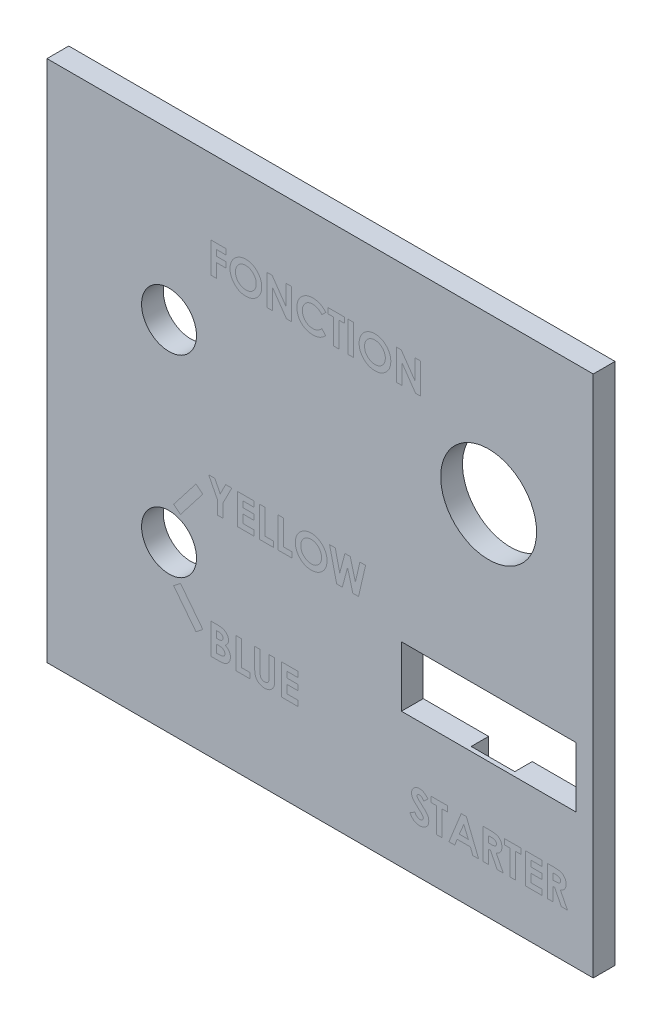
from build123d import *

# Parameters (mm, degrees)
ESQUISSE1_W                  = 62.66
ESQUISSE1_H                  = 60
BOSS_EXTRU_1_DEPTH           = 2.5
ENL_V_MAT_EXTRU_2_DEPTH      = 44.449037964
ENL_V_MAT_EXTRU_2_DEPTH_BACK = 44.449037964
ESQUISSE2_R                  = 3.15
ESQUISSE2_R_2                = 5.5
ESQUISSE2_W                  = 20
ESQUISSE2_H                  = 6.9
ESQUISSE3_W                  = 5
ESQUISSE3_H                  = 5
ENL_V_MAT_EXTRU_3_DEPTH      = 2
ESQUISSE4_W                  = 0.628205128
ESQUISSE4_H                  = 3.5
ENL_V_MAT_EXTRU_4_DEPTH      = 0.1
BOSS_EXTRU_2_DEPTH           = 0.1
BOSS_EXTRU_2_2_DEPTH         = 0.1
BOSS_EXTRU_2_3_DEPTH         = 0.1
BOSS_EXTRU_2_4_DEPTH         = 0.1
BOSS_EXTRU_2_5_DEPTH         = 0.1
BOSS_EXTRU_2_6_DEPTH         = 0.1
BOSS_EXTRU_2_7_DEPTH         = 0.1
BOSS_EXTRU_2_8_DEPTH         = 0.1
BOSS_EXTRU_2_9_DEPTH         = 0.1
BOSS_EXTRU_2_10_DEPTH        = 0.1
BOSS_EXTRU_2_11_DEPTH        = 0.1
BOSS_EXTRU_2_12_DEPTH        = 0.1
BOSS_EXTRU_2_13_DEPTH        = 0.1
BOSS_EXTRU_2_14_DEPTH        = 0.1
BOSS_EXTRU_2_15_DEPTH        = 0.1
BOSS_EXTRU_2_16_DEPTH        = 0.1
BOSS_EXTRU_2_17_DEPTH        = 0.1
ESQUISSE4_2_W                = 0.628205128
ESQUISSE4_2_H                = 3.5
BOSS_EXTRU_2_18_DEPTH        = 0.1
BOSS_EXTRU_2_19_DEPTH        = 0.1
BOSS_EXTRU_2_20_DEPTH        = 0.1
BOSS_EXTRU_2_21_DEPTH        = 0.1
BOSS_EXTRU_2_22_DEPTH        = 0.1
BOSS_EXTRU_2_23_DEPTH        = 0.1
BOSS_EXTRU_2_24_DEPTH        = 0.1
BOSS_EXTRU_2_25_DEPTH        = 0.1
BOSS_EXTRU_2_26_DEPTH        = 0.1
BOSS_EXTRU_2_27_DEPTH        = 0.1


with BuildPart() as part:
    # Esquisse1 → Boss.-Extru.1 (new body)
    with BuildSketch(Plane.XY):
        Rectangle(ESQUISSE1_W, ESQUISSE1_H)
    extrude(amount=BOSS_EXTRU_1_DEPTH)

    # Esquisse2 → Enlèv. mat.-Extru.2 (cut, two sides: drawn at the far end of the back side and taken through both)
    with BuildSketch(Plane.XY.offset(-ENL_V_MAT_EXTRU_2_DEPTH_BACK)):
        with Locations((-17.33, 11.05)):
            Circle(ESQUISSE2_R)
        with Locations((-17.33, -11.05)):
            Circle(ESQUISSE2_R)
        with Locations((19.33, 11.05)):
            Circle(ESQUISSE2_R_2)
        with Locations((19.33, -11.05)):
            Rectangle(ESQUISSE2_W, ESQUISSE2_H)
    extrude(amount=ENL_V_MAT_EXTRU_2_DEPTH + ENL_V_MAT_EXTRU_2_DEPTH_BACK, mode=Mode.SUBTRACT)

    # Esquisse3 → Enlèv. mat.-Extru.3 (cut)
    with BuildSketch(Plane(origin=(0, 0, 0), x_dir=(-1, 0, 0), z_dir=(0, 0, -1))):
        with Locations((-19.33, -5.1)):
            Rectangle(ESQUISSE3_W, ESQUISSE3_H)
        with Locations((-19.33, -17)):
            Rectangle(ESQUISSE3_W, ESQUISSE3_H)
    extrude(amount=-ENL_V_MAT_EXTRU_3_DEPTH, mode=Mode.SUBTRACT)

    # Esquisse4 → Enlèv. mat.-Extru.4 (cut)
    # profile 1 of 27: a face of its own
    with BuildSketch(Plane.XY.offset(2.5)):
        Polygon((-16.798051564, -7.008690028), (-14.240197924, -3.713827712), (-13.450286381, -4.327048515), (-16.008140021, -7.621910831), align=None)
    # profile 2 of 27: a face of its own
    with BuildSketch(Plane.XY.offset(2.5)):
        Polygon((-16.798051564, -15.091309972), (-16.008140021, -14.478089169), (-13.450286381, -17.772951485), (-14.240197924, -18.386172288), align=None)
    # profile 3 of 27: a face of its own
    with BuildSketch(Plane.XY.offset(2.5)):
        Polygon((-12.778535522, -2.068299363), (-12.079517092, -2.068299363), (-11.454817573, -3.296664748), (-10.82871581, -2.068299363), (-10.131099624, -2.068299363), (-11.140715009, -4.052474043), (-11.140715009, -5.568299363), (-11.768920137, -5.568299363), (-11.768920137, -4.052474043), align=None)
    # profile 4 of 27: a face of its own
    with BuildSketch(Plane.XY.offset(2.5)):
        Polygon((-9.480458599, -2.068299363), (-7.595843214, -2.068299363), (-7.595843214, -2.696504491), (-8.852253471, -2.696504491), (-8.852253471, -3.369581414), (-7.595843214, -3.369581414), (-7.595843214, -3.997786543), (-8.852253471, -3.997786543), (-8.852253471, -4.940094235), (-7.595843214, -4.940094235), (-7.595843214, -5.568299363), (-9.480458599, -5.568299363), align=None)
    # profile 5 of 27: a face of its own
    with BuildSketch(Plane.XY.offset(2.5)):
        Polygon((-6.967638086, -2.068299363), (-6.339432958, -2.068299363), (-6.339432958, -4.940094235), (-5.352253471, -4.940094235), (-5.352253471, -5.568299363), (-6.967638086, -5.568299363), align=None)
    # profile 6 of 27: a face of its own
    with BuildSketch(Plane.XY.offset(2.5)):
        Polygon((-4.813791932, -2.068299363), (-4.185586804, -2.068299363), (-4.185586804, -4.940094235), (-3.198407317, -4.940094235), (-3.198407317, -5.568299363), (-4.813791932, -5.568299363), align=None)
    # profile 7 of 27: a face of its own
    with BuildSketch(Plane.XY.offset(2.5)):
        with BuildLine():
            add(Edge.make_bspline(
                [(-1.015114048, -1.978555773), (-0.954262258, -1.980131335), (-0.834127043, -1.983241851), (-0.657451494, -2.009170428), (-0.487191935, -2.051417328), (-0.323425358, -2.110143574), (-0.166561814, -2.186939771), (-0.016047994, -2.279628698), (0.127576969, -2.389959802), (0.262841321, -2.51535924), (0.387849978, -2.651725654), (0.496170052, -2.798548342), (0.588541438, -2.952022981), (0.665099089, -3.112560812), (0.723411991, -3.281273634), (0.764332565, -3.457301237), (0.790622007, -3.640593541), (0.793645698, -3.765390617), (0.795182427, -3.82881619)],
                knots=[0, 0, 0, 0, 1.014329547, 2.002516266, 2.970391464, 3.935626869, 4.897733899, 5.877609409, 6.878433252, 7.912639331, 8.949961323, 9.958554974, 10.949718813, 11.932905612, 12.9188844, 13.919928257, 14.942845884, 16, 16, 16, 16], degree=3))
            add(Edge.make_bspline(
                [(0.795182427, -3.82881619), (0.793545877, -3.891527103), (0.790321003, -4.015100971), (0.765405816, -4.196704164), (0.723796133, -4.370846144), (0.666472264, -4.537921085), (0.591303079, -4.697119734), (0.500733036, -4.849458551), (0.392372164, -4.993523797), (0.27017281, -5.12923816), (0.135641925, -5.252428065), (-0.006847638, -5.360988956), (-0.156637951, -5.452979359), (-0.313509769, -5.528357136), (-0.477799495, -5.586855053), (-0.649101315, -5.628129585), (-0.827404627, -5.653212951), (-0.948659527, -5.65641676), (-1.010206195, -5.658042953)],
                knots=[0, 0, 0, 0, 1.051557043, 2.072126891, 3.067553643, 4.050577992, 5.02905126, 6.015227836, 7.017913613, 8.04756643, 9.074058332, 10.072836633, 11.047628519, 12.017157415, 12.98668631, 13.966869689, 14.968021931, 16, 16, 16, 16], degree=3))
            add(Edge.make_bspline(
                [(-1.010206195, -5.658042953), (-1.07457663, -5.656584178), (-1.201055737, -5.653717885), (-1.386158476, -5.626460746), (-1.563502894, -5.585401972), (-1.731599196, -5.524123955), (-1.892159299, -5.447521282), (-2.044003521, -5.353180497), (-2.187080832, -5.241257505), (-2.320570517, -5.114618697), (-2.441512496, -4.976048065), (-2.548267515, -4.829660481), (-2.638317741, -4.676574216), (-2.71166647, -4.516717624), (-2.769491662, -4.351084174), (-2.810280764, -4.178665111), (-2.83437586, -3.999873958), (-2.837732167, -3.878435433), (-2.839432958, -3.81689712)],
                knots=[0, 0, 0, 0, 1.067978421, 2.098431617, 3.099715153, 4.085208694, 5.062210972, 6.048429807, 7.046490867, 8.072918869, 9.098532598, 10.095778865, 11.076610158, 12.041847152, 13.011192615, 13.984257998, 14.978533688, 16, 16, 16, 16], degree=3))
            add(Edge.make_bspline(
                [(-2.839432958, -3.81689712), (-2.838899152, -3.775497364), (-2.837838299, -3.693222069), (-2.82505921, -3.571294281), (-2.806660996, -3.45174636), (-2.77945091, -3.335054945), (-2.74639761, -3.220396833), (-2.703572392, -3.108839289), (-2.654825703, -2.999190572), (-2.597869787, -2.89274577), (-2.534540316, -2.790484266), (-2.465442225, -2.692888444), (-2.390401767, -2.60113838), (-2.309660672, -2.514631131), (-2.222940697, -2.433935315), (-2.131382552, -2.35790857), (-2.033210543, -2.288570438), (-1.930573348, -2.224227543), (-1.82404961, -2.166043379), (-1.714072978, -2.116518758), (-1.602909188, -2.07326975), (-1.489073242, -2.039135721), (-1.373785094, -2.011333912), (-1.255813124, -1.992948098), (-1.136223142, -1.980169363), (-1.055579551, -1.979094913), (-1.015114048, -1.978555773)],
                knots=[0, 0, 0, 0, 1.034744296, 2.056386356, 3.06226378, 4.057406941, 5.050368692, 6.043467995, 7.042652155, 8.049140477, 9.059438543, 10.048523776, 11.036952808, 12.020949711, 13.004946614, 13.997082645, 14.994316842, 16.007702937, 17.024872941, 18.026463647, 19.021641123, 20.005082605, 20.995858141, 21.984425357, 22.988620895, 24, 24, 24, 24], degree=3))
        make_face()
        with BuildLine():
            add(Edge.make_bspline(
                [(-1.024929753, -2.606760902), (-1.065882999, -2.607859769), (-1.146708319, -2.610028494), (-1.265264344, -2.626551244), (-1.379082315, -2.652939953), (-1.487531294, -2.691163676), (-1.591081307, -2.739812775), (-1.689915918, -2.798717263), (-1.782666471, -2.869901916), (-1.870569706, -2.949545148), (-1.949975813, -3.038286011), (-2.020133614, -3.133386938), (-2.078844393, -3.234689112), (-2.128015039, -3.341251459), (-2.165029637, -3.454272245), (-2.191394025, -3.572866166), (-2.208055335, -3.697237565), (-2.210155514, -3.782021386), (-2.21122783, -3.825310581)],
                knots=[0, 0, 0, 0, 1.033739768, 2.040188636, 3.016340934, 3.979330865, 4.937572243, 5.900995986, 6.878200029, 7.884839167, 8.891893314, 9.879764717, 10.863503415, 11.843163062, 12.837761627, 13.859916423, 14.907309254, 16, 16, 16, 16], degree=3))
            add(Edge.make_bspline(
                [(-2.21122783, -3.825310581), (-2.209806102, -3.873284747), (-2.207019752, -3.967306165), (-2.187414655, -4.104462075), (-2.153872285, -4.233992219), (-2.105437755, -4.355263085), (-2.04536623, -4.469621295), (-1.970766931, -4.575665227), (-1.882848012, -4.674029821), (-1.81511599, -4.731459168), (-1.780739048, -4.760607055)],
                knots=[0, 0, 0, 0, 1.078454662, 2.113592447, 3.107694534, 4.079536787, 5.043276885, 6.005368276, 6.987637804, 8, 8, 8, 8], degree=3))
            add(Edge.make_bspline(
                [(-1.780739048, -4.760607055), (-1.752577769, -4.782140395), (-1.69688969, -4.824721924), (-1.607999393, -4.879298889), (-1.516459889, -4.926076792), (-1.4215804, -4.963872785), (-1.323561305, -4.993602477), (-1.222416046, -5.014421692), (-1.118287938, -5.02748755), (-1.047871631, -5.029049167), (-1.01230956, -5.029837825)],
                knots=[0, 0, 0, 0, 1.023928204, 2.024787132, 3.009472467, 3.9914905, 4.972207045, 5.96565515, 6.972602802, 8, 8, 8, 8], degree=3))
            add(Edge.make_bspline(
                [(-1.01230956, -5.029837825), (-0.972060506, -5.02872964), (-0.892869226, -5.026549252), (-0.776520186, -5.010229906), (-0.665054271, -4.982611681), (-0.557779492, -4.94472327), (-0.455005182, -4.89546334), (-0.357233627, -4.834731819), (-0.264293406, -4.763274414), (-0.176502159, -4.682585292), (-0.09625681, -4.593494851), (-0.026245414, -4.497886665), (0.034332075, -4.39786727), (0.082480216, -4.292021041), (0.120957177, -4.181347119), (0.147004257, -4.065355351), (0.163806316, -3.9445239), (0.165907087, -3.862293828), (0.166977299, -3.820402728)],
                knots=[0, 0, 0, 0, 1.026359118, 2.019393844, 2.989460624, 3.950973911, 4.916101784, 5.890408035, 6.881132271, 7.902007068, 8.92769091, 9.933912415, 10.920395702, 11.90457117, 12.894218921, 13.903490204, 14.931958862, 16, 16, 16, 16], degree=3))
            add(Edge.make_bspline(
                [(0.166977299, -3.820402728), (0.165870057, -3.778752515), (0.163690622, -3.696770421), (0.147342553, -3.576249627), (0.119899476, -3.460769929), (0.08189729, -3.350142736), (0.03337051, -3.244259592), (-0.026637775, -3.143492846), (-0.097917005, -3.047939914), (-0.178826693, -2.958251953), (-0.266891915, -2.875834462), (-0.361438731, -2.804311061), (-0.459821613, -2.7421595), (-0.564297946, -2.693472477), (-0.672730232, -2.654683629), (-0.785780129, -2.626118964), (-0.903875821, -2.610144567), (-0.984218763, -2.607898844), (-1.024929753, -2.606760902)],
                knots=[0, 0, 0, 0, 1.055025985, 2.07665775, 3.074803781, 4.057872707, 5.035505728, 6.020516407, 7.023567878, 8.050795229, 9.077271434, 10.074415901, 11.050397877, 12.019801805, 12.988065821, 13.964604439, 14.968634123, 16, 16, 16, 16], degree=3))
        make_face(mode=Mode.SUBTRACT)
    # profile 8 of 27: a face of its own
    with BuildSketch(Plane.XY.offset(2.5)):
        Polygon((1.086849093, -2.068299363), (1.735386754, -2.068299363), (2.25351576, -4.302774523), (2.84736592, -2.068299363), (3.45664076, -2.068299363), (4.048387555, -4.302774523), (4.563712074, -2.068299363), (5.215054222, -2.068299363), (4.40595967, -5.568299363), (3.74970967, -5.568299363), (3.150951658, -3.305779331), (2.549389158, -5.568299363), (1.89804701, -5.568299363), align=None)
    # profile 9 of 27: a face of its own
    with BuildSketch(Plane.XY.offset(2.5)):
        with BuildLine():
            Line((-12.486868855, -19.968370243), (-12.486868855, -16.468370243))
            Line((-12.486868855, -16.468370243), (-11.925971419, -16.468370243))
            add(Edge.make_bspline(
                [(-11.925971419, -16.468370243), (-11.886705092, -16.468365762), (-11.810725492, -16.468357091), (-11.701106759, -16.472206541), (-11.599444641, -16.477186236), (-11.506062668, -16.482757356), (-11.420801896, -16.49235751), (-11.343791978, -16.502475024), (-11.274879048, -16.514676121), (-11.232273928, -16.525620884), (-11.212229432, -16.530770083)],
                knots=[0, 0, 0, 0, 1.311965854, 2.538629056, 3.664479157, 4.713267157, 5.663616078, 6.530575999, 7.308677837, 8, 8, 8, 8], degree=3))
            add(Edge.make_bspline(
                [(-11.212229432, -16.530770083), (-11.185908974, -16.53803312), (-11.134259785, -16.552285531), (-11.060281664, -16.581068891), (-10.990103096, -16.613063635), (-10.923809769, -16.649563655), (-10.861808749, -16.691009607), (-10.804335662, -16.73773042), (-10.750150955, -16.787850721), (-10.701178603, -16.842767349), (-10.656915665, -16.90079694), (-10.618459109, -16.961924287), (-10.58504529, -17.025214715), (-10.558305483, -17.09146469), (-10.53815754, -17.160369114), (-10.52342142, -17.231633754), (-10.513870418, -17.305484109), (-10.512967973, -17.355726919), (-10.512509881, -17.38123082)],
                knots=[0, 0, 0, 0, 1.099996261, 2.158545794, 3.195537121, 4.207578794, 5.205712374, 6.197378256, 7.190519799, 8.17788031, 9.159561366, 10.129234751, 11.085776129, 12.040971148, 13.00380137, 13.975669004, 14.972423361, 16, 16, 16, 16], degree=3))
            add(Edge.make_bspline(
                [(-10.512509881, -17.38123082), (-10.513707657, -17.413996639), (-10.516065331, -17.478492128), (-10.531126315, -17.573224333), (-10.559368007, -17.662759882), (-10.596321574, -17.748748883), (-10.646566872, -17.830870595), (-10.710368683, -17.909085973), (-10.786693626, -17.985803384), (-10.845239071, -18.031790297), (-10.875690971, -18.055709987)],
                knots=[0, 0, 0, 0, 0.986156485, 1.941127874, 2.875419072, 3.804401753, 4.751181392, 5.761612777, 6.835722519, 8, 8, 8, 8], degree=3))
            add(Edge.make_bspline(
                [(-10.875690971, -18.055709987), (-10.851014212, -18.068307258), (-10.802629916, -18.093007022), (-10.733938429, -18.13360606), (-10.670337611, -18.176788286), (-10.611542295, -18.221684857), (-10.558785778, -18.270199002), (-10.509889658, -18.319535271), (-10.467266213, -18.372520425), (-10.429151044, -18.427265974), (-10.396021959, -18.48456464), (-10.367170179, -18.544319657), (-10.342800116, -18.606735162), (-10.322162915, -18.671493511), (-10.306771686, -18.738817441), (-10.296736277, -18.808731032), (-10.289052541, -18.880995841), (-10.288454818, -18.930220824), (-10.288150907, -18.95524925)],
                knots=[0, 0, 0, 0, 1.164658916, 2.283573913, 3.35186032, 4.395461096, 5.390182219, 6.362969632, 7.312859996, 8.245001507, 9.165155236, 10.092416118, 11.032087915, 11.979892451, 12.947605196, 13.931445124, 14.948243989, 16, 16, 16, 16], degree=3))
            add(Edge.make_bspline(
                [(-10.288150907, -18.95524925), (-10.290123091, -19.003052112), (-10.294015189, -19.097390869), (-10.32247231, -19.23590183), (-10.371807915, -19.367222785), (-10.438055459, -19.490831806), (-10.51968518, -19.603150617), (-10.613535951, -19.70154092), (-10.718662909, -19.784826127), (-10.815655233, -19.841037181), (-10.899545956, -19.878760055), (-10.969031074, -19.902082714), (-11.043656619, -19.92368879), (-11.124789549, -19.938861023), (-11.210959038, -19.952748319), (-11.303005241, -19.961322623), (-11.400756127, -19.967133218), (-11.467895661, -19.967949565), (-11.502493855, -19.968370243)],
                knots=[0, 0, 0, 0, 1.284142165, 2.534249414, 3.780121997, 5.041676246, 6.291546858, 7.49970053, 8.684500223, 9.883330709, 10.50184324, 11.153274765, 11.851151195, 12.587658647, 13.369265475, 14.195992086, 15.070362669, 16, 16, 16, 16], degree=3))
            Line((-11.502493855, -19.968370243), (-12.486868855, -19.968370243))
        make_face()
        with BuildLine():
            Line((-11.858663727, -17.096575372), (-11.858663727, -17.859395885))
            Line((-11.858663727, -17.859395885), (-11.69179674, -17.859395885))
            add(Edge.make_bspline(
                [(-11.69179674, -17.859395885), (-11.669118017, -17.859198117), (-11.625338115, -17.85881634), (-11.562102691, -17.853899181), (-11.503303958, -17.845510202), (-11.449164929, -17.833805466), (-11.399181277, -17.818942158), (-11.353672313, -17.801058397), (-11.312838132, -17.779238265), (-11.265398258, -17.746736216), (-11.21525089, -17.698907995), (-11.171106727, -17.629810221), (-11.145106109, -17.550348043), (-11.142210341, -17.494305163), (-11.140715009, -17.465365436)],
                knots=[0, 0, 0, 0, 1.065314748, 2.056525647, 2.977365736, 3.853934255, 4.656397591, 5.425096493, 6.14721249, 6.826394842, 8.123232004, 9.372140726, 10.643011755, 12, 12, 12, 12], degree=3))
            add(Edge.make_bspline(
                [(-11.140715009, -17.465365436), (-11.141911549, -17.438258573), (-11.14422501, -17.385848544), (-11.170404289, -17.312260194), (-11.211065885, -17.247045856), (-11.259072614, -17.202411975), (-11.304280278, -17.17192835), (-11.342989854, -17.151856181), (-11.385476521, -17.133887781), (-11.432562774, -17.120148704), (-11.483979726, -17.109839384), (-11.539477615, -17.102268423), (-11.599152195, -17.097115306), (-11.640369555, -17.09675921), (-11.661648503, -17.096575372)],
                knots=[0, 0, 0, 0, 1.347982417, 2.606269829, 3.849316587, 5.153353503, 5.842674298, 6.568177932, 7.326619318, 8.142485038, 9.012069166, 9.942760135, 10.937925643, 12, 12, 12, 12], degree=3))
            Line((-11.661648503, -17.096575372), (-11.858663727, -17.096575372))
        make_face(mode=Mode.SUBTRACT)
        with BuildLine():
            Line((-11.858663727, -18.442729218), (-11.858663727, -19.340165115))
            Line((-11.858663727, -19.340165115), (-11.677774304, -19.340165115))
            add(Edge.make_bspline(
                [(-11.677774304, -19.340165115), (-11.642012235, -19.339960808), (-11.573255194, -19.339568001), (-11.474760855, -19.334821966), (-11.385204877, -19.326268073), (-11.30482455, -19.315589226), (-11.233496757, -19.30112106), (-11.171462601, -19.28272664), (-11.117871365, -19.262489575), (-11.073044386, -19.237494396), (-11.036423311, -19.208406207), (-11.003376631, -19.178677379), (-10.976432427, -19.144382366), (-10.95511367, -19.10699336), (-10.936662324, -19.06743913), (-10.925533775, -19.024175097), (-10.917060888, -18.978483504), (-10.916594602, -18.946879617), (-10.916356035, -18.930709987)],
                knots=[0, 0, 0, 0, 1.753078804, 3.370512758, 4.83203934, 6.162291463, 7.344201807, 8.395507345, 9.331626367, 10.147333109, 10.898971645, 11.62040215, 12.321813352, 13.025280112, 13.727906689, 14.453419512, 15.208716525, 16, 16, 16, 16], degree=3))
            add(Edge.make_bspline(
                [(-10.916356035, -18.930709987), (-10.916882145, -18.912219761), (-10.917906866, -18.876205776), (-10.926275776, -18.823567493), (-10.941484819, -18.774426163), (-10.960641352, -18.727525176), (-10.987298684, -18.684543751), (-11.018980012, -18.643994464), (-11.057259145, -18.607250438), (-11.100306262, -18.572089259), (-11.150516463, -18.541303741), (-11.207913304, -18.514591851), (-11.272808597, -18.492283065), (-11.34540336, -18.474520794), (-11.425379345, -18.459446201), (-11.513320289, -18.450445005), (-11.608493788, -18.443750419), (-11.674488641, -18.443077353), (-11.708623663, -18.442729218)],
                knots=[0, 0, 0, 0, 0.845221588, 1.646264278, 2.427170338, 3.19324141, 3.95557735, 4.731569926, 5.540061037, 6.376114724, 7.268642756, 8.224665384, 9.265483498, 10.400594375, 11.639216012, 12.983232105, 14.439614077, 16, 16, 16, 16], degree=3))
            Line((-11.708623663, -18.442729218), (-11.858663727, -18.442729218))
        make_face(mode=Mode.SUBTRACT)
    # profile 10 of 27: a face of its own
    with BuildSketch(Plane.XY.offset(2.5)):
        Polygon((-9.659945778, -16.468370243), (-9.03174065, -16.468370243), (-9.03174065, -19.340165115), (-8.044561163, -19.340165115), (-8.044561163, -19.968370243), (-9.659945778, -19.968370243), align=None)
    # profile 11 of 27: a face of its own
    with BuildSketch(Plane.XY.offset(2.5)):
        with BuildLine():
            Line((-7.506099624, -16.468370243), (-6.877894496, -16.468370243))
            Line((-6.877894496, -16.468370243), (-6.877894496, -18.745613833))
            add(Edge.make_bspline(
                [(-6.877894496, -18.745613833), (-6.877860338, -18.769223307), (-6.87779436, -18.814824762), (-6.874491509, -18.880247919), (-6.871469172, -18.940385499), (-6.866016018, -18.995171664), (-6.857959842, -19.044629848), (-6.850158834, -19.089077755), (-6.839600941, -19.127719594), (-6.823734115, -19.171704124), (-6.799288547, -19.221123145), (-6.759345843, -19.272628783), (-6.713255381, -19.319635153), (-6.658013307, -19.358761475), (-6.595926101, -19.390411143), (-6.527334905, -19.413860044), (-6.452336408, -19.426894519), (-6.400479061, -19.428884471), (-6.373787926, -19.429908705)],
                knots=[0, 0, 0, 0, 1.155499968, 2.231836252, 3.205919964, 4.102923608, 4.924856345, 5.658536265, 6.31071849, 6.882491295, 7.94666036, 8.992281882, 10.060072772, 11.158554251, 12.289267114, 13.461410017, 14.693379945, 16, 16, 16, 16], degree=3))
            add(Edge.make_bspline(
                [(-6.373787926, -19.429908705), (-6.345431888, -19.429081255), (-6.290142416, -19.427467869), (-6.210617311, -19.411630731), (-6.136936851, -19.386412583), (-6.070661102, -19.35041986), (-6.011856018, -19.307276273), (-5.962078748, -19.258079064), (-5.922794708, -19.202730109), (-5.897190833, -19.151666483), (-5.882815518, -19.104666862), (-5.872040503, -19.062674484), (-5.864141225, -19.013127635), (-5.856974741, -18.956800096), (-5.852668235, -18.893108421), (-5.847998533, -18.822564828), (-5.846287043, -18.744686637), (-5.845995332, -18.690458592), (-5.845843214, -18.66218034)],
                knots=[0, 0, 0, 0, 1.261321664, 2.459363699, 3.594844139, 4.716940403, 5.803436589, 6.833651888, 7.818396249, 8.814403945, 9.360733334, 10.004355033, 10.743453831, 11.592799886, 12.532235708, 13.585170094, 14.740740724, 16, 16, 16, 16], degree=3))
            Line((-5.845843214, -18.66218034), (-5.845843214, -16.468370243))
            Line((-5.845843214, -16.468370243), (-5.217638086, -16.468370243))
            Line((-5.217638086, -16.468370243), (-5.217638086, -18.556310949))
            add(Edge.make_bspline(
                [(-5.217638086, -18.556310949), (-5.217725324, -18.598612527), (-5.217893073, -18.679954338), (-5.220469201, -18.796848244), (-5.225953312, -18.903612077), (-5.230559332, -19.000277032), (-5.239473558, -19.086712887), (-5.248760091, -19.163288745), (-5.260596576, -19.229733242), (-5.278208554, -19.305372226), (-5.308601614, -19.392467746), (-5.357599211, -19.492754462), (-5.41979849, -19.590941231), (-5.493314928, -19.685947932), (-5.576321712, -19.774206095), (-5.666978403, -19.851685339), (-5.763844692, -19.917224424), (-5.867932762, -19.969220841), (-5.979154029, -20.009774126), (-6.098608944, -20.037023892), (-6.226216049, -20.055434175), (-6.314356688, -20.05720271), (-6.35976549, -20.058113833)],
                knots=[0, 0, 0, 0, 1.170808336, 2.251350247, 3.235597562, 4.129743112, 4.929140599, 5.639994148, 6.264258765, 6.79612947, 7.788252245, 8.809469599, 9.879094798, 10.999557536, 12.129761673, 13.226370002, 14.293821979, 15.358369427, 16.438775801, 17.562147481, 18.744053101, 20, 20, 20, 20], degree=3))
            add(Edge.make_bspline(
                [(-6.35976549, -20.058113833), (-6.389936001, -20.057605651), (-6.449461801, -20.056603017), (-6.537004933, -20.047762409), (-6.621632566, -20.034734676), (-6.703185687, -20.015728556), (-6.781947351, -19.991176199), (-6.857896632, -19.960953957), (-6.930751285, -19.925230406), (-7.000103625, -19.884334126), (-7.065868309, -19.840111839), (-7.125973835, -19.791089572), (-7.182488576, -19.740892707), (-7.233779845, -19.687408747), (-7.280232884, -19.631199183), (-7.321752023, -19.572136624), (-7.358275579, -19.510226318), (-7.390722282, -19.444352334), (-7.418493493, -19.371166536), (-7.441905668, -19.288065674), (-7.462359094, -19.193747226), (-7.477558874, -19.087998698), (-7.491339083, -18.971168624), (-7.500061196, -18.842952644), (-7.504624126, -18.703347081), (-7.505595364, -18.606561438), (-7.506099624, -18.556310949)],
                knots=[0, 0, 0, 0, 1.001158378, 1.975264943, 2.917723546, 3.841610987, 4.75185031, 5.653588123, 6.552117133, 7.442167995, 8.324307438, 9.179605724, 10.014504199, 10.831958861, 11.636465792, 12.43274043, 13.225645099, 14.020104002, 14.867201867, 15.819789774, 16.883317127, 18.068162734, 19.364263498, 20.787406516, 22.332041935, 24, 24, 24, 24], degree=3))
            Line((-7.506099624, -18.556310949), (-7.506099624, -16.468370243))
        make_face()
    # profile 12 of 27: a face of its own
    with BuildSketch(Plane.XY.offset(2.5)):
        Polygon((-4.409945778, -16.468370243), (-2.525330394, -16.468370243), (-2.525330394, -17.096575372), (-3.78174065, -17.096575372), (-3.78174065, -17.769652295), (-2.525330394, -17.769652295), (-2.525330394, -18.397857423), (-3.78174065, -18.397857423), (-3.78174065, -19.340165115), (-2.525330394, -19.340165115), (-2.525330394, -19.968370243), (-4.409945778, -19.968370243), align=None)
    # profile 13 of 27: a face of its own
    with BuildSketch(Plane.XY.offset(2.5)):
        Polygon((-12.486868855, 21.387906745), (-10.78174065, 21.387906745), (-10.78174065, 20.759701617), (-11.858663727, 20.759701617), (-11.858663727, 20.086624694), (-10.78174065, 20.086624694), (-10.78174065, 19.458419566), (-11.858663727, 19.458419566), (-11.858663727, 17.887906745), (-12.486868855, 17.887906745), align=None)
    # profile 14 of 27: a face of its own
    with BuildSketch(Plane.XY.offset(2.5)):
        with BuildLine():
            add(Edge.make_bspline(
                [(-8.508703791, 21.477650335), (-8.447852002, 21.476074773), (-8.327716787, 21.472964257), (-8.151041238, 21.44703568), (-7.980781679, 21.40478878), (-7.817015101, 21.346062535), (-7.660151558, 21.269266337), (-7.509637738, 21.17657741), (-7.366012775, 21.066246306), (-7.230748423, 20.940846868), (-7.105739766, 20.804480455), (-6.997419691, 20.657657767), (-6.905048306, 20.504183127), (-6.828490654, 20.343645297), (-6.770177753, 20.174932474), (-6.729257178, 19.998904871), (-6.702967736, 19.815612567), (-6.699944046, 19.690815491), (-6.698407317, 19.627389918)],
                knots=[0, 0, 0, 0, 1.014329547, 2.002516266, 2.970391464, 3.935626869, 4.897733899, 5.877609409, 6.878433252, 7.912639331, 8.949961323, 9.958554974, 10.949718813, 11.932905612, 12.9188844, 13.919928257, 14.942845884, 16, 16, 16, 16], degree=3))
            add(Edge.make_bspline(
                [(-6.698407317, 19.627389918), (-6.700043867, 19.564679005), (-6.703268741, 19.441105138), (-6.728183928, 19.259501945), (-6.76979361, 19.085359965), (-6.827117479, 18.918285023), (-6.902286664, 18.759086374), (-6.992856707, 18.606747557), (-7.101217579, 18.462682311), (-7.223416934, 18.326967949), (-7.357947818, 18.203778043), (-7.500437381, 18.095217152), (-7.650227694, 18.00322675), (-7.807099512, 17.927848972), (-7.971389239, 17.869351055), (-8.142691058, 17.828076524), (-8.320994371, 17.802993158), (-8.44224927, 17.799789348), (-8.503795939, 17.798163155)],
                knots=[0, 0, 0, 0, 1.051557043, 2.072126891, 3.067553643, 4.050577992, 5.02905126, 6.015227836, 7.017913613, 8.04756643, 9.074058332, 10.072836633, 11.047628519, 12.017157415, 12.98668631, 13.966869689, 14.968021931, 16, 16, 16, 16], degree=3))
            add(Edge.make_bspline(
                [(-8.503795939, 17.798163155), (-8.568166374, 17.79962193), (-8.69464548, 17.802488223), (-8.879748219, 17.829745363), (-9.057092637, 17.870804136), (-9.225188939, 17.932082153), (-9.385749042, 18.008684827), (-9.537593264, 18.103025612), (-9.680670575, 18.214948603), (-9.814160261, 18.341587411), (-9.935102239, 18.480158043), (-10.041857258, 18.626545628), (-10.131907485, 18.779631892), (-10.205256214, 18.939488484), (-10.263081405, 19.105121934), (-10.303870508, 19.277540997), (-10.327965604, 19.45633215), (-10.331321911, 19.577770676), (-10.333022701, 19.639308989)],
                knots=[0, 0, 0, 0, 1.067978421, 2.098431617, 3.099715153, 4.085208694, 5.062210972, 6.048429807, 7.046490867, 8.072918869, 9.098532598, 10.095778865, 11.076610158, 12.041847152, 13.011192615, 13.984257998, 14.978533688, 16, 16, 16, 16], degree=3))
            add(Edge.make_bspline(
                [(-10.333022701, 19.639308989), (-10.332488895, 19.680708744), (-10.331428043, 19.762984039), (-10.318648954, 19.884911827), (-10.300250739, 20.004459748), (-10.273040654, 20.121151163), (-10.239987354, 20.235809276), (-10.197162135, 20.34736682), (-10.148415447, 20.457015537), (-10.091459531, 20.563460338), (-10.02813006, 20.665721843), (-9.959031968, 20.763317665), (-9.88399151, 20.855067729), (-9.803250416, 20.941574978), (-9.716530441, 21.022270794), (-9.624972296, 21.098297538), (-9.526800287, 21.16763567), (-9.424163091, 21.231978565), (-9.317639353, 21.29016273), (-9.207662721, 21.33968735), (-9.096498931, 21.382936358), (-8.982662985, 21.417070387), (-8.867374838, 21.444872197), (-8.749402868, 21.463258011), (-8.629812886, 21.476036746), (-8.549169295, 21.477111195), (-8.508703791, 21.477650335)],
                knots=[0, 0, 0, 0, 1.034744296, 2.056386356, 3.06226378, 4.057406941, 5.050368692, 6.043467995, 7.042652155, 8.049140477, 9.059438543, 10.048523776, 11.036952808, 12.020949711, 13.004946614, 13.997082645, 14.994316842, 16.007702937, 17.024872941, 18.026463647, 19.021641123, 20.005082605, 20.995858141, 21.984425357, 22.988620895, 24, 24, 24, 24], degree=3))
        make_face()
        with BuildLine():
            add(Edge.make_bspline(
                [(-8.518519496, 20.849445207), (-8.559472743, 20.848346339), (-8.640298063, 20.846177614), (-8.758854088, 20.829654865), (-8.872672059, 20.803266155), (-8.981121037, 20.765042432), (-9.084671051, 20.716393333), (-9.183505662, 20.657488845), (-9.276256215, 20.586304192), (-9.364159449, 20.506660961), (-9.443565557, 20.417920097), (-9.513723358, 20.32281917), (-9.572434137, 20.221516997), (-9.621604782, 20.114954649), (-9.65861938, 20.001933863), (-9.684983769, 19.883339942), (-9.701645078, 19.758968543), (-9.703745257, 19.674184723), (-9.704817573, 19.630895527)],
                knots=[0, 0, 0, 0, 1.033739768, 2.040188636, 3.016340934, 3.979330865, 4.937572243, 5.900995986, 6.878200029, 7.884839167, 8.891893314, 9.879764717, 10.863503415, 11.843163062, 12.837761627, 13.859916423, 14.907309254, 16, 16, 16, 16], degree=3))
            add(Edge.make_bspline(
                [(-9.704817573, 19.630895527), (-9.703395846, 19.582921361), (-9.700609496, 19.488899944), (-9.681004399, 19.351744034), (-9.647462028, 19.222213889), (-9.599027498, 19.100943023), (-9.538955974, 18.986584813), (-9.464356675, 18.880540882), (-9.376437756, 18.782176287), (-9.308705733, 18.72474694), (-9.274328791, 18.695599053)],
                knots=[0, 0, 0, 0, 1.078454662, 2.113592447, 3.107694534, 4.079536787, 5.043276885, 6.005368276, 6.987637804, 8, 8, 8, 8], degree=3))
            add(Edge.make_bspline(
                [(-9.274328791, 18.695599053), (-9.246167513, 18.674065713), (-9.190479434, 18.631484184), (-9.101589136, 18.576907219), (-9.010049633, 18.530129316), (-8.915170143, 18.492333324), (-8.817151049, 18.462603631), (-8.71600579, 18.441784416), (-8.611877682, 18.428718559), (-8.541461375, 18.427156941), (-8.505899304, 18.426368284)],
                knots=[0, 0, 0, 0, 1.023928204, 2.024787132, 3.009472467, 3.9914905, 4.972207045, 5.96565515, 6.972602802, 8, 8, 8, 8], degree=3))
            add(Edge.make_bspline(
                [(-8.505899304, 18.426368284), (-8.46565025, 18.427476468), (-8.38645897, 18.429656857), (-8.270109929, 18.445976202), (-8.158644015, 18.473594427), (-8.051369236, 18.511482839), (-7.948594926, 18.560742769), (-7.85082337, 18.621474289), (-7.75788315, 18.692931695), (-7.670091903, 18.773620816), (-7.589846553, 18.862711257), (-7.519835157, 18.958319443), (-7.459257669, 19.058338839), (-7.411109528, 19.164185067), (-7.372632566, 19.27485899), (-7.346585487, 19.390850758), (-7.329783427, 19.511682208), (-7.327682657, 19.593912281), (-7.326612445, 19.63580338)],
                knots=[0, 0, 0, 0, 1.026359118, 2.019393844, 2.989460624, 3.950973911, 4.916101784, 5.890408035, 6.881132271, 7.902007068, 8.92769091, 9.933912415, 10.920395702, 11.90457117, 12.894218921, 13.903490204, 14.931958862, 16, 16, 16, 16], degree=3))
            add(Edge.make_bspline(
                [(-7.326612445, 19.63580338), (-7.327719686, 19.677453594), (-7.329899122, 19.759435688), (-7.34624719, 19.879956482), (-7.373690268, 19.99543618), (-7.411692454, 20.106063373), (-7.460219233, 20.211946516), (-7.520227519, 20.312713262), (-7.591506749, 20.408266194), (-7.672416436, 20.497954155), (-7.760481659, 20.580371647), (-7.855028474, 20.651895047), (-7.953411357, 20.714046608), (-8.05788769, 20.762733631), (-8.166319975, 20.80152248), (-8.279369873, 20.830087144), (-8.397465565, 20.846061541), (-8.477808506, 20.848307265), (-8.518519496, 20.849445207)],
                knots=[0, 0, 0, 0, 1.055025985, 2.07665775, 3.074803781, 4.057872707, 5.035505728, 6.020516407, 7.023567878, 8.050795229, 9.077271434, 10.074415901, 11.050397877, 12.019801805, 12.988065821, 13.964604439, 14.968634123, 16, 16, 16, 16], degree=3))
        make_face(mode=Mode.SUBTRACT)
    # profile 15 of 27: a face of its own
    with BuildSketch(Plane.XY.offset(2.5)):
        Polygon((-6.070202189, 21.387906745), (-5.5043969, 21.387906745), (-3.916356035, 19.084721649), (-3.916356035, 21.387906745), (-3.288150907, 21.387906745), (-3.288150907, 17.887906745), (-3.858162926, 17.887906745), (-5.44199706, 20.184080623), (-5.44199706, 17.887906745), (-6.070202189, 17.887906745), align=None)
    # profile 16 of 27: a face of its own
    with BuildSketch(Plane.XY.offset(2.5)):
        with BuildLine():
            Line((0.660567042, 20.780735271), (0.199930023, 20.340430784))
            add(Edge.make_bspline(
                [(0.199930023, 20.340430784), (0.160855038, 20.380834383), (0.084529351, 20.459755271), (-0.038460054, 20.564239572), (-0.166364557, 20.6513131), (-0.296696031, 20.72464587), (-0.431798762, 20.780127338), (-0.570110594, 20.820557618), (-0.71251469, 20.845206431), (-0.808888304, 20.848026691), (-0.857361644, 20.849445207)],
                knots=[0, 0, 0, 0, 1.115251505, 2.178435587, 3.19620269, 4.182487026, 5.141301733, 6.088180966, 7.038406374, 8, 8, 8, 8], degree=3))
            add(Edge.make_bspline(
                [(-0.857361644, 20.849445207), (-0.897842773, 20.84832453), (-0.977727821, 20.846112998), (-1.095020006, 20.829900288), (-1.207216043, 20.802329869), (-1.314699996, 20.764332724), (-1.41715559, 20.715166435), (-1.514797635, 20.654869056), (-1.607385399, 20.583985158), (-1.693695851, 20.502881497), (-1.772649619, 20.414269653), (-1.8424103, 20.319721026), (-1.900846061, 20.219452223), (-1.94880334, 20.114478692), (-1.986160206, 20.004314563), (-2.012837702, 19.889034005), (-2.028267252, 19.768499725), (-2.030570216, 19.68656142), (-2.03174065, 19.644917963)],
                knots=[0, 0, 0, 0, 1.035432265, 2.043311493, 3.022114605, 3.98653278, 4.95457646, 5.923598177, 6.917315552, 7.932509744, 8.948865224, 9.949768934, 10.933144597, 11.912367597, 12.897413939, 13.903909035, 14.934704909, 16, 16, 16, 16], degree=3))
            add(Edge.make_bspline(
                [(-2.03174065, 19.644917963), (-2.031403344, 19.615689671), (-2.030738508, 19.558080107), (-2.023460697, 19.472859574), (-2.011741704, 19.390175509), (-1.994781419, 19.310153157), (-1.973572415, 19.232723171), (-1.948689425, 19.157217565), (-1.917474079, 19.084679657), (-1.882824575, 19.014266967), (-1.842527601, 18.947900792), (-1.799080028, 18.884615137), (-1.75196823, 18.82472022), (-1.700887059, 18.768460895), (-1.645117612, 18.716716369), (-1.586101323, 18.667930622), (-1.522842669, 18.623324927), (-1.456655692, 18.581779855), (-1.38696862, 18.545689297), (-1.315672225, 18.512998224), (-1.24168551, 18.486448212), (-1.165909308, 18.46504648), (-1.088614417, 18.446847504), (-1.009044819, 18.435641835), (-0.927890285, 18.427155913), (-0.873043442, 18.426631957), (-0.845442573, 18.426368284)],
                knots=[0, 0, 0, 0, 1.103660481, 2.175337485, 3.227646561, 4.255952547, 5.262355991, 6.258840057, 7.255597736, 8.242457506, 9.22035537, 10.185017736, 11.140346927, 12.096287581, 13.051739095, 14.01125915, 14.986044842, 15.97314143, 16.960198552, 17.947847494, 18.933482797, 19.925264591, 20.920966487, 21.929612487, 22.958107872, 24, 24, 24, 24], degree=3))
            add(Edge.make_bspline(
                [(-0.845442573, 18.426368284), (-0.798626756, 18.427722446), (-0.70664585, 18.430383021), (-0.571650644, 18.451188348), (-0.443013662, 18.485411934), (-0.340233329, 18.525828), (-0.259707652, 18.56573939), (-0.198404646, 18.60265546), (-0.135012558, 18.643950138), (-0.07058428, 18.691181929), (-0.004395118, 18.743784033), (0.062386533, 18.802908534), (0.131470298, 18.866608547), (0.176726388, 18.912072497), (0.199930023, 18.935382707)],
                knots=[0, 0, 0, 0, 1.404581149, 2.759636711, 4.088442092, 5.392261763, 6.066678138, 6.783632037, 7.538459478, 8.336747902, 9.180226004, 10.074962426, 11.012997595, 12, 12, 12, 12], degree=3))
            Line((0.199930023, 18.935382707), (0.646544606, 18.466332226))
            add(Edge.make_bspline(
                [(0.646544606, 18.466332226), (0.615150005, 18.436021724), (0.553874457, 18.376862106), (0.461441995, 18.29286097), (0.369125862, 18.217376611), (0.279156224, 18.147669277), (0.190059286, 18.085769714), (0.101844495, 18.0316161), (0.015510481, 17.983838813), (-0.070735509, 17.943243594), (-0.157430141, 17.908774036), (-0.24662873, 17.87909801), (-0.338603964, 17.853993159), (-0.433917586, 17.833736841), (-0.531680567, 17.817494009), (-0.632807841, 17.806530192), (-0.736658209, 17.799159582), (-0.807101523, 17.798497271), (-0.842638086, 17.798163155)],
                knots=[0, 0, 0, 0, 1.244526981, 2.429050516, 3.560637417, 4.644440555, 5.67424972, 6.652764056, 7.595344123, 8.486817594, 9.369275933, 10.254498637, 11.166417451, 12.086725134, 13.032340136, 13.991389299, 14.986715468, 16, 16, 16, 16], degree=3))
            add(Edge.make_bspline(
                [(-0.842638086, 17.798163155), (-0.90791435, 17.799827178), (-1.035641854, 17.803083206), (-1.22282318, 17.827208175), (-1.400640416, 17.867653261), (-1.569526157, 17.924853767), (-1.729426701, 17.997924733), (-1.880301142, 18.087506306), (-2.021906302, 18.193360482), (-2.153098291, 18.314246548), (-2.271767689, 18.447755059), (-2.376657694, 18.591106574), (-2.46342271, 18.745005611), (-2.535465572, 18.907178591), (-2.591802143, 19.078365573), (-2.631453539, 19.258751728), (-2.655906265, 19.448162882), (-2.658581428, 19.577535066), (-2.659945778, 19.64351572)],
                knots=[0, 0, 0, 0, 1.078019885, 2.10938526, 3.111377082, 4.085535484, 5.04941344, 6.010039228, 6.978205633, 7.964457913, 8.951525778, 9.924444315, 10.892603023, 11.863865945, 12.85144698, 13.863884204, 14.910567087, 16, 16, 16, 16], degree=3))
            add(Edge.make_bspline(
                [(-2.659945778, 19.64351572), (-2.65936927, 19.686547739), (-2.658226771, 19.771826683), (-2.646219004, 19.897449478), (-2.629479478, 20.019909232), (-2.602923742, 20.137934408), (-2.570913422, 20.253115022), (-2.531104383, 20.364199196), (-2.483560206, 20.471506197), (-2.429813351, 20.575215662), (-2.369010073, 20.674648185), (-2.301086135, 20.768949483), (-2.227790167, 20.858847544), (-2.147360983, 20.943149704), (-2.060967327, 21.022596152), (-1.968219141, 21.096756353), (-1.869674259, 21.166693848), (-1.765065955, 21.230605118), (-1.656426492, 21.288416259), (-1.545126098, 21.339408155), (-1.431438226, 21.382025637), (-1.315843558, 21.417375266), (-1.197853708, 21.443761264), (-1.078310858, 21.463734614), (-0.956197842, 21.474899844), (-0.874209531, 21.476727664), (-0.832822381, 21.477650335)],
                knots=[0, 0, 0, 0, 1.071919942, 2.124283339, 3.142214191, 4.149696895, 5.136002878, 6.119640489, 7.086990633, 8.058538607, 9.028339693, 9.988281803, 10.952401235, 11.916291999, 12.888973767, 13.874849856, 14.873389453, 15.898127285, 16.927174885, 17.938320013, 18.946391617, 19.950418109, 20.947802303, 21.956882652, 22.968648068, 24, 24, 24, 24], degree=3))
            add(Edge.make_bspline(
                [(-0.832822381, 21.477650335), (-0.797514899, 21.477121437), (-0.727267034, 21.47606914), (-0.622656175, 21.467297099), (-0.518881944, 21.453520699), (-0.416315886, 21.432735043), (-0.314224343, 21.408059844), (-0.213948912, 21.375751074), (-0.113907695, 21.339736862), (-0.015669688, 21.296689225), (0.080902233, 21.24969884), (0.17354572, 21.196386542), (0.263816249, 21.14003311), (0.349713477, 21.077303301), (0.432846446, 21.010472442), (0.512780445, 20.93922873), (0.588814008, 20.862384322), (0.63652845, 20.808089211), (0.660567042, 20.780735271)],
                knots=[0, 0, 0, 0, 0.996412454, 1.982464992, 2.961075852, 3.949442424, 4.934965278, 5.923860011, 6.921385422, 7.934793307, 8.949617135, 9.951082467, 10.950285876, 11.951772932, 12.951063433, 13.960125323, 14.972308753, 16, 16, 16, 16], degree=3))
        make_face()
    # profile 17 of 27: a face of its own
    with BuildSketch(Plane.XY.offset(2.5)):
        Polygon((0.929797811, 21.387906745), (2.814413196, 21.387906745), (2.814413196, 20.759701617), (2.186208068, 20.759701617), (2.186208068, 17.887906745), (1.55800294, 17.887906745), (1.55800294, 20.759701617), (0.929797811, 20.759701617), align=None)
    # profile 18 of 27: a face of its own
    with BuildSketch(Plane.XY.offset(2.5)):
        with Locations((3.532361914, 19.637906745)):
            Rectangle(ESQUISSE4_W, ESQUISSE4_H)
    # profile 19 of 27: a face of its own
    with BuildSketch(Plane.XY.offset(2.5)):
        with BuildLine():
            add(Edge.make_bspline(
                [(6.298988517, 21.477650335), (6.359840306, 21.476074773), (6.479975521, 21.472964257), (6.65665107, 21.44703568), (6.826910629, 21.40478878), (6.990677206, 21.346062535), (7.14754075, 21.269266337), (7.29805457, 21.17657741), (7.441679533, 21.066246306), (7.576943885, 20.940846868), (7.701952542, 20.804480455), (7.810272616, 20.657657767), (7.902644002, 20.504183127), (7.979201653, 20.343645297), (8.037514555, 20.174932474), (8.07843513, 19.998904871), (8.104724572, 19.815612567), (8.107748262, 19.690815491), (8.109284991, 19.627389918)],
                knots=[0, 0, 0, 0, 1.014329547, 2.002516266, 2.970391464, 3.935626869, 4.897733899, 5.877609409, 6.878433252, 7.912639331, 8.949961323, 9.958554974, 10.949718813, 11.932905612, 12.9188844, 13.919928257, 14.942845884, 16, 16, 16, 16], degree=3))
            add(Edge.make_bspline(
                [(8.109284991, 19.627389918), (8.107648441, 19.564679005), (8.104423567, 19.441105138), (8.07950838, 19.259501945), (8.037898697, 19.085359965), (7.980574828, 18.918285023), (7.905405643, 18.759086374), (7.8148356, 18.606747557), (7.706474728, 18.462682311), (7.584275374, 18.326967949), (7.449744489, 18.203778043), (7.307254926, 18.095217152), (7.157464613, 18.00322675), (7.000592795, 17.927848972), (6.836303069, 17.869351055), (6.665001249, 17.828076524), (6.486697937, 17.802993158), (6.365443037, 17.799789348), (6.303896369, 17.798163155)],
                knots=[0, 0, 0, 0, 1.051557043, 2.072126891, 3.067553643, 4.050577992, 5.02905126, 6.015227836, 7.017913613, 8.04756643, 9.074058332, 10.072836633, 11.047628519, 12.017157415, 12.98668631, 13.966869689, 14.968021931, 16, 16, 16, 16], degree=3))
            add(Edge.make_bspline(
                [(6.303896369, 17.798163155), (6.239525934, 17.79962193), (6.113046827, 17.802488223), (5.927944088, 17.829745363), (5.75059967, 17.870804136), (5.582503368, 17.932082153), (5.421943265, 18.008684827), (5.270099043, 18.103025612), (5.127021732, 18.214948603), (4.993532047, 18.341587411), (4.872590068, 18.480158043), (4.765835049, 18.626545628), (4.675784823, 18.779631892), (4.602436094, 18.939488484), (4.544610902, 19.105121934), (4.5038218, 19.277540997), (4.479726704, 19.45633215), (4.476370397, 19.577770676), (4.474669606, 19.639308989)],
                knots=[0, 0, 0, 0, 1.067978421, 2.098431617, 3.099715153, 4.085208694, 5.062210972, 6.048429807, 7.046490867, 8.072918869, 9.098532598, 10.095778865, 11.076610158, 12.041847152, 13.011192615, 13.984257998, 14.978533688, 16, 16, 16, 16], degree=3))
            add(Edge.make_bspline(
                [(4.474669606, 19.639308989), (4.475203412, 19.680708744), (4.476264265, 19.762984039), (4.489043354, 19.884911827), (4.507441568, 20.004459748), (4.534651654, 20.121151163), (4.567704954, 20.235809276), (4.610530172, 20.34736682), (4.659276861, 20.457015537), (4.716232777, 20.563460338), (4.779562248, 20.665721843), (4.848660339, 20.763317665), (4.923700797, 20.855067729), (5.004441892, 20.941574978), (5.091161867, 21.022270794), (5.182720012, 21.098297538), (5.280892021, 21.16763567), (5.383529217, 21.231978565), (5.490052955, 21.29016273), (5.600029586, 21.33968735), (5.711193376, 21.382936358), (5.825029322, 21.417070387), (5.94031747, 21.444872197), (6.05828944, 21.463258011), (6.177879422, 21.476036746), (6.258523013, 21.477111195), (6.298988517, 21.477650335)],
                knots=[0, 0, 0, 0, 1.034744296, 2.056386356, 3.06226378, 4.057406941, 5.050368692, 6.043467995, 7.042652155, 8.049140477, 9.059438543, 10.048523776, 11.036952808, 12.020949711, 13.004946614, 13.997082645, 14.994316842, 16.007702937, 17.024872941, 18.026463647, 19.021641123, 20.005082605, 20.995858141, 21.984425357, 22.988620895, 24, 24, 24, 24], degree=3))
        make_face()
        with BuildLine():
            add(Edge.make_bspline(
                [(6.289172811, 20.849445207), (6.248219565, 20.848346339), (6.167394245, 20.846177614), (6.04883822, 20.829654865), (5.935020249, 20.803266155), (5.826571271, 20.765042432), (5.723021257, 20.716393333), (5.624186646, 20.657488845), (5.531436093, 20.586304192), (5.443532859, 20.506660961), (5.364126751, 20.417920097), (5.29396895, 20.32281917), (5.235258171, 20.221516997), (5.186087525, 20.114954649), (5.149072927, 20.001933863), (5.122708539, 19.883339942), (5.106047229, 19.758968543), (5.103947051, 19.674184723), (5.102874735, 19.630895527)],
                knots=[0, 0, 0, 0, 1.033739768, 2.040188636, 3.016340934, 3.979330865, 4.937572243, 5.900995986, 6.878200029, 7.884839167, 8.891893314, 9.879764717, 10.863503415, 11.843163062, 12.837761627, 13.859916423, 14.907309254, 16, 16, 16, 16], degree=3))
            add(Edge.make_bspline(
                [(5.102874735, 19.630895527), (5.104296462, 19.582921361), (5.107082812, 19.488899944), (5.126687909, 19.351744034), (5.160230279, 19.222213889), (5.208664809, 19.100943023), (5.268736334, 18.986584813), (5.343335633, 18.880540882), (5.431254552, 18.782176287), (5.498986574, 18.72474694), (5.533363517, 18.695599053)],
                knots=[0, 0, 0, 0, 1.078454662, 2.113592447, 3.107694534, 4.079536787, 5.043276885, 6.005368276, 6.987637804, 8, 8, 8, 8], degree=3))
            add(Edge.make_bspline(
                [(5.533363517, 18.695599053), (5.561524795, 18.674065713), (5.617212874, 18.631484184), (5.706103172, 18.576907219), (5.797642675, 18.530129316), (5.892522164, 18.492333324), (5.990541259, 18.462603631), (6.091686518, 18.441784416), (6.195814626, 18.428718559), (6.266230933, 18.427156941), (6.301793004, 18.426368284)],
                knots=[0, 0, 0, 0, 1.023928204, 2.024787132, 3.009472467, 3.9914905, 4.972207045, 5.96565515, 6.972602802, 8, 8, 8, 8], degree=3))
            add(Edge.make_bspline(
                [(6.301793004, 18.426368284), (6.342042058, 18.427476468), (6.421233338, 18.429656857), (6.537582378, 18.445976202), (6.649048293, 18.473594427), (6.756323072, 18.511482839), (6.859097382, 18.560742769), (6.956868937, 18.621474289), (7.049809158, 18.692931695), (7.137600405, 18.773620816), (7.217845754, 18.862711257), (7.28785715, 18.958319443), (7.348434639, 19.058338839), (7.39658278, 19.164185067), (7.435059741, 19.27485899), (7.461106821, 19.390850758), (7.477908881, 19.511682208), (7.480009651, 19.593912281), (7.481079863, 19.63580338)],
                knots=[0, 0, 0, 0, 1.026359118, 2.019393844, 2.989460624, 3.950973911, 4.916101784, 5.890408035, 6.881132271, 7.902007068, 8.92769091, 9.933912415, 10.920395702, 11.90457117, 12.894218921, 13.903490204, 14.931958862, 16, 16, 16, 16], degree=3))
            add(Edge.make_bspline(
                [(7.481079863, 19.63580338), (7.479972622, 19.677453594), (7.477793186, 19.759435688), (7.461445117, 19.879956482), (7.43400204, 19.99543618), (7.395999854, 20.106063373), (7.347473075, 20.211946516), (7.287464789, 20.312713262), (7.216185559, 20.408266194), (7.135275871, 20.497954155), (7.047210649, 20.580371647), (6.952663834, 20.651895047), (6.854280951, 20.714046608), (6.749804618, 20.762733631), (6.641372332, 20.80152248), (6.528322435, 20.830087144), (6.410226743, 20.846061541), (6.329883801, 20.848307265), (6.289172811, 20.849445207)],
                knots=[0, 0, 0, 0, 1.055025985, 2.07665775, 3.074803781, 4.057872707, 5.035505728, 6.020516407, 7.023567878, 8.050795229, 9.077271434, 10.074415901, 11.050397877, 12.019801805, 12.988065821, 13.964604439, 14.968634123, 16, 16, 16, 16], degree=3))
        make_face(mode=Mode.SUBTRACT)
    # profile 20 of 27: a face of its own
    with BuildSketch(Plane.XY.offset(2.5)):
        Polygon((8.737490119, 21.387906745), (9.303295408, 21.387906745), (10.891336273, 19.084721649), (10.891336273, 21.387906745), (11.519541401, 21.387906745), (11.519541401, 17.887906745), (10.949529382, 17.887906745), (9.365695247, 20.184080623), (9.365695247, 17.887906745), (8.737490119, 17.887906745), align=None)
    # profile 21 of 27: a face of its own
    with BuildSketch(Plane.XY.offset(2.5)):
        with BuildLine():
            Line((26.060769231, -21.241198269), (26.792740385, -21.241198269))
            add(Edge.make_bspline(
                [(26.792740385, -21.241198269), (26.841123455, -21.241370001), (26.934177728, -21.24170029), (27.068356908, -21.24691138), (27.191618937, -21.254163039), (27.304146316, -21.265229263), (27.405890904, -21.279901739), (27.496954673, -21.29719816), (27.577334962, -21.316911139), (27.647709666, -21.341475067), (27.711219356, -21.369182806), (27.770419217, -21.401019505), (27.826615286, -21.436630654), (27.879431952, -21.476953278), (27.929328205, -21.521261983), (27.976398177, -21.56960137), (28.019976726, -21.622381337), (28.059794011, -21.679268382), (28.096084262, -21.739112249), (28.128157232, -21.801995103), (28.154239024, -21.867960677), (28.177285084, -21.936055624), (28.193884414, -22.007253375), (28.205429006, -22.080860808), (28.213881504, -22.157137029), (28.214367482, -22.208955707), (28.214615385, -22.235388974)],
                knots=[0, 0, 0, 0, 1.749336639, 3.364467119, 4.854658419, 6.213483162, 7.451590619, 8.570285859, 9.5643256, 10.440900261, 11.26203566, 12.067320669, 12.869050712, 13.665104639, 14.467235401, 15.27997916, 16.102287765, 16.939272006, 17.78853747, 18.631303466, 19.488103222, 20.351255419, 21.228522269, 22.127379805, 23.044756219, 24, 24, 24, 24], degree=3))
            add(Edge.make_bspline(
                [(28.214615385, -22.235388974), (28.213971422, -22.262979233), (28.21270873, -22.317078701), (28.205907181, -22.396546408), (28.193476087, -22.472575552), (28.174647387, -22.544943528), (28.153006241, -22.61455104), (28.124229069, -22.680113787), (28.091751185, -22.742585283), (28.053178152, -22.801081845), (28.010846132, -22.8569028), (27.961614884, -22.907909438), (27.908673836, -22.956843175), (27.849046979, -23.000638966), (27.785362719, -23.042258124), (27.716355719, -23.079976166), (27.642476341, -23.114741234), (27.590535479, -23.134128638), (27.563974359, -23.14404282)],
                knots=[0, 0, 0, 0, 1.099860209, 2.156625411, 3.176576793, 4.16617041, 5.135385252, 6.078461593, 7.016046972, 7.938469504, 8.868247731, 9.803980173, 10.76021508, 11.73834243, 12.748633912, 13.790971185, 14.870363756, 16, 16, 16, 16], degree=3))
            Line((27.563974359, -23.14404282), (28.371666667, -24.741198269))
            Line((28.371666667, -24.741198269), (27.673349359, -24.741198269))
            Line((27.673349359, -24.741198269), (26.902115385, -23.215557243))
            Line((26.902115385, -23.215557243), (26.688974359, -23.215557243))
            Line((26.688974359, -23.215557243), (26.688974359, -24.741198269))
            Line((26.688974359, -24.741198269), (26.060769231, -24.741198269))
            Line((26.060769231, -24.741198269), (26.060769231, -21.241198269))
        make_face()
        with BuildLine():
            Line((26.688974359, -22.587352115), (26.933665865, -22.587352115))
            add(Edge.make_bspline(
                [(26.933665865, -22.587352115), (26.963581436, -22.587015186), (27.020863326, -22.586370039), (27.103242207, -22.583377579), (27.178061877, -22.576167229), (27.245643637, -22.567057222), (27.306327553, -22.556538403), (27.359572345, -22.541464297), (27.406198435, -22.525312011), (27.445653301, -22.505238909), (27.479362632, -22.482411438), (27.508468481, -22.456478864), (27.532543192, -22.426465211), (27.552357907, -22.393186122), (27.567771601, -22.35634725), (27.579022417, -22.316353004), (27.58530996, -22.272747797), (27.586033363, -22.242654267), (27.586410256, -22.226975513)],
                knots=[0, 0, 0, 0, 1.688639943, 3.233382647, 4.650958383, 5.928841754, 7.082724185, 8.122798841, 9.049171256, 9.863274652, 10.613301712, 11.341792392, 12.054588806, 12.776240173, 13.521029143, 14.301969904, 15.115324896, 16, 16, 16, 16], degree=3))
            add(Edge.make_bspline(
                [(27.586410256, -22.226975513), (27.585697704, -22.208426401), (27.584298028, -22.17199011), (27.570408891, -22.119534626), (27.548300384, -22.070983487), (27.517995677, -22.026556059), (27.479830838, -21.987607909), (27.436033674, -21.953274804), (27.385658937, -21.926126753), (27.339015721, -21.908220188), (27.296581297, -21.897506506), (27.258285568, -21.889522764), (27.213938884, -21.883864457), (27.163507764, -21.877862816), (27.10712076, -21.873971055), (27.044470528, -21.871130846), (26.975737001, -21.869968776), (26.927823204, -21.869597283), (26.902816506, -21.869403397)],
                knots=[0, 0, 0, 0, 1.020303359, 2.004196876, 2.966617323, 3.9489082, 4.950758222, 5.960522915, 7.003732012, 8.091992268, 8.70421221, 9.413913587, 10.24622431, 11.166358409, 12.212345909, 13.359657661, 14.621978493, 16, 16, 16, 16], degree=3))
            Line((26.902816506, -21.869403397), (26.688974359, -21.869403397))
            Line((26.688974359, -21.869403397), (26.688974359, -22.587352115))
        make_face(mode=Mode.SUBTRACT)
    # profile 22 of 27: a face of its own
    with BuildSketch(Plane.XY.offset(2.5)):
        Polygon((23.547948718, -21.241198269), (25.432564103, -21.241198269), (25.432564103, -21.869403397), (24.176153846, -21.869403397), (24.176153846, -22.54248032), (25.432564103, -22.54248032), (25.432564103, -23.170685448), (24.176153846, -23.170685448), (24.176153846, -24.112993141), (25.432564103, -24.112993141), (25.432564103, -24.741198269), (23.547948718, -24.741198269), align=None)
    # profile 23 of 27: a face of its own
    with BuildSketch(Plane.XY.offset(2.5)):
        Polygon((21.16974359, -21.241198269), (23.054358974, -21.241198269), (23.054358974, -21.869403397), (22.426153846, -21.869403397), (22.426153846, -24.741198269), (21.797948718, -24.741198269), (21.797948718, -21.869403397), (21.16974359, -21.869403397), align=None)
    # profile 24 of 27: a face of its own
    with BuildSketch(Plane.XY.offset(2.5)):
        with BuildLine():
            Line((18.701794872, -21.241198269), (19.433766026, -21.241198269))
            add(Edge.make_bspline(
                [(19.433766026, -21.241198269), (19.482149096, -21.241370001), (19.575203369, -21.24170029), (19.709382549, -21.24691138), (19.832644578, -21.254163039), (19.945171957, -21.265229263), (20.046916545, -21.279901739), (20.137980314, -21.29719816), (20.218360603, -21.316911139), (20.288735307, -21.341475067), (20.352244997, -21.369182806), (20.411444859, -21.401019505), (20.467640927, -21.436630654), (20.520457593, -21.476953278), (20.570353846, -21.521261983), (20.617423818, -21.56960137), (20.661002367, -21.622381337), (20.700819652, -21.679268382), (20.737109903, -21.739112249), (20.769182873, -21.801995103), (20.795264666, -21.867960677), (20.818310725, -21.936055624), (20.834910055, -22.007253375), (20.846454647, -22.080860808), (20.854907145, -22.157137029), (20.855393123, -22.208955707), (20.855641026, -22.235388974)],
                knots=[0, 0, 0, 0, 1.749336639, 3.364467119, 4.854658419, 6.213483162, 7.451590619, 8.570285859, 9.5643256, 10.440900261, 11.26203566, 12.067320669, 12.869050712, 13.665104639, 14.467235401, 15.27997916, 16.102287765, 16.939272006, 17.78853747, 18.631303466, 19.488103222, 20.351255419, 21.228522269, 22.127379805, 23.044756219, 24, 24, 24, 24], degree=3))
            add(Edge.make_bspline(
                [(20.855641026, -22.235388974), (20.854997063, -22.262979233), (20.853734371, -22.317078701), (20.846932822, -22.396546408), (20.834501728, -22.472575552), (20.815673028, -22.544943528), (20.794031882, -22.61455104), (20.76525471, -22.680113787), (20.732776826, -22.742585283), (20.694203793, -22.801081845), (20.651871774, -22.8569028), (20.602640525, -22.907909438), (20.549699477, -22.956843175), (20.49007262, -23.000638966), (20.42638836, -23.042258124), (20.35738136, -23.079976166), (20.283501982, -23.114741234), (20.23156112, -23.134128638), (20.205, -23.14404282)],
                knots=[0, 0, 0, 0, 1.099860209, 2.156625411, 3.176576793, 4.16617041, 5.135385252, 6.078461593, 7.016046972, 7.938469504, 8.868247731, 9.803980173, 10.76021508, 11.73834243, 12.748633912, 13.790971185, 14.870363756, 16, 16, 16, 16], degree=3))
            Line((20.205, -23.14404282), (21.012692308, -24.741198269))
            Line((21.012692308, -24.741198269), (20.314375, -24.741198269))
            Line((20.314375, -24.741198269), (19.543141026, -23.215557243))
            Line((19.543141026, -23.215557243), (19.33, -23.215557243))
            Line((19.33, -23.215557243), (19.33, -24.741198269))
            Line((19.33, -24.741198269), (18.701794872, -24.741198269))
            Line((18.701794872, -24.741198269), (18.701794872, -21.241198269))
        make_face()
        with BuildLine():
            Line((19.33, -22.587352115), (19.574691506, -22.587352115))
            add(Edge.make_bspline(
                [(19.574691506, -22.587352115), (19.604607077, -22.587015186), (19.661888967, -22.586370039), (19.744267848, -22.583377579), (19.819087518, -22.576167229), (19.886669278, -22.567057222), (19.947353194, -22.556538403), (20.000597986, -22.541464297), (20.047224076, -22.525312011), (20.086678942, -22.505238909), (20.120388273, -22.482411438), (20.149494122, -22.456478864), (20.173568833, -22.426465211), (20.193383548, -22.393186122), (20.208797243, -22.35634725), (20.220048058, -22.316353004), (20.226335601, -22.272747797), (20.227059004, -22.242654267), (20.227435897, -22.226975513)],
                knots=[0, 0, 0, 0, 1.688639943, 3.233382647, 4.650958383, 5.928841754, 7.082724185, 8.122798841, 9.049171256, 9.863274652, 10.613301712, 11.341792392, 12.054588806, 12.776240173, 13.521029143, 14.301969904, 15.115324896, 16, 16, 16, 16], degree=3))
            add(Edge.make_bspline(
                [(20.227435897, -22.226975513), (20.226723345, -22.208426401), (20.225323669, -22.17199011), (20.211434532, -22.119534626), (20.189326025, -22.070983487), (20.159021318, -22.026556059), (20.120856479, -21.987607909), (20.077059315, -21.953274804), (20.026684578, -21.926126753), (19.980041362, -21.908220188), (19.937606938, -21.897506506), (19.899311209, -21.889522764), (19.854964525, -21.883864457), (19.804533405, -21.877862816), (19.748146401, -21.873971055), (19.68549617, -21.871130846), (19.616762642, -21.869968776), (19.568848845, -21.869597283), (19.543842147, -21.869403397)],
                knots=[0, 0, 0, 0, 1.020303359, 2.004196876, 2.966617323, 3.9489082, 4.950758222, 5.960522915, 7.003732012, 8.091992268, 8.70421221, 9.413913587, 10.24622431, 11.166358409, 12.212345909, 13.359657661, 14.621978493, 16, 16, 16, 16], degree=3))
            Line((19.543842147, -21.869403397), (19.33, -21.869403397))
            Line((19.33, -21.869403397), (19.33, -22.587352115))
        make_face(mode=Mode.SUBTRACT)
    # profile 25 of 27: a face of its own
    with BuildSketch(Plane.XY.offset(2.5)):
        Polygon((16.188273237, -21.241198269), (16.772307692, -21.241198269), (18.185769231, -24.741198269), (17.514795673, -24.741198269), (17.242760417, -24.023249551), (15.719222756, -24.023249551), (15.446486378, -24.741198269), (14.775512821, -24.741198269), align=None)
        Polygon((16.480641026, -22.180000352), (15.957604167, -23.395044423), (17.004379006, -23.395044423), align=None, mode=Mode.SUBTRACT)
    # profile 26 of 27: a face of its own
    with BuildSketch(Plane.XY.offset(2.5)):
        Polygon((12.733846154, -21.241198269), (14.618461538, -21.241198269), (14.618461538, -21.869403397), (13.99025641, -21.869403397), (13.99025641, -24.741198269), (13.362051282, -24.741198269), (13.362051282, -21.869403397), (12.733846154, -21.869403397), align=None)
    # profile 27 of 27: a face of its own
    with BuildSketch(Plane.XY.offset(2.5)):
        with BuildLine():
            Line((12.374871795, -21.708846506), (11.905120192, -22.138634166))
            add(Edge.make_bspline(
                [(11.905120192, -22.138634166), (11.884998048, -22.11024979), (11.846366337, -22.055755745), (11.783748362, -21.982786935), (11.72141314, -21.920539109), (11.658783173, -21.869272311), (11.595303331, -21.829298025), (11.531083807, -21.800995788), (11.46648868, -21.783003788), (11.423090725, -21.780763351), (11.401714744, -21.779659807)],
                knots=[0, 0, 0, 0, 1.299362458, 2.494594718, 3.587462134, 4.587049575, 5.512617175, 6.380583204, 7.202344345, 8, 8, 8, 8], degree=3))
            add(Edge.make_bspline(
                [(11.401714744, -21.779659807), (11.381775841, -21.780359063), (11.343279059, -21.781709143), (11.288399039, -21.795128832), (11.239675777, -21.818289244), (11.197156823, -21.848573432), (11.163475538, -21.885058857), (11.136583643, -21.923322686), (11.121441247, -21.965557301), (11.11944821, -21.994565737), (11.118461538, -22.008926634)],
                knots=[0, 0, 0, 0, 1.185010067, 2.2879431, 3.333075148, 4.379039566, 5.372662701, 6.27520591, 7.14612461, 8, 8, 8, 8], degree=3))
            add(Edge.make_bspline(
                [(11.118461538, -22.008926634), (11.119079836, -22.023494622), (11.120325, -22.052832524), (11.132351594, -22.095830874), (11.150479105, -22.137845267), (11.167800682, -22.163421427), (11.176654647, -22.176494743)],
                knots=[0, 0, 0, 0, 0.967525499, 1.948461899, 2.951351359, 4, 4, 4, 4], degree=3))
            add(Edge.make_bspline(
                [(11.176654647, -22.176494743), (11.18470386, -22.186656495), (11.203232084, -22.210047505), (11.238561614, -22.24709522), (11.282928082, -22.292481912), (11.338038806, -22.344646868), (11.401605987, -22.405466143), (11.476576045, -22.472548908), (11.560791017, -22.547972638), (11.620649067, -22.600494993), (11.652015224, -22.628017179)],
                knots=[0, 0, 0, 0, 0.473873513, 1.090794244, 1.870441696, 2.795289791, 3.865433203, 5.087734844, 6.473946851, 8, 8, 8, 8], degree=3))
            add(Edge.make_bspline(
                [(11.652015224, -22.628017179), (11.681456875, -22.653497443), (11.737331011, -22.701853689), (11.81682881, -22.770487617), (11.886694136, -22.832235888), (11.947944766, -22.886171793), (11.999652201, -22.932861243), (12.042033819, -22.972527414), (12.075607238, -23.004398078), (12.094691762, -23.023647978), (12.102836538, -23.031863333)],
                knots=[0, 0, 0, 0, 1.543621617, 2.929473131, 4.163658386, 5.240097082, 6.164993805, 6.925417477, 7.541396219, 8, 8, 8, 8], degree=3))
            add(Edge.make_bspline(
                [(12.102836538, -23.031863333), (12.133736123, -23.065303301), (12.193135976, -23.129586664), (12.270334845, -23.229205658), (12.333872011, -23.32645411), (12.383025567, -23.423161906), (12.42014831, -23.520724347), (12.446320336, -23.621534147), (12.461994936, -23.726644705), (12.463735183, -23.79836983), (12.464615385, -23.834647788)],
                knots=[0, 0, 0, 0, 1.206664779, 2.319633467, 3.337109185, 4.282041471, 5.190008762, 6.099243693, 7.03861361, 8, 8, 8, 8], degree=3))
            add(Edge.make_bspline(
                [(12.464615385, -23.834647788), (12.463988879, -23.86999621), (12.462759653, -23.939351128), (12.447703985, -24.04084172), (12.426235487, -24.137972622), (12.393041422, -24.229686911), (12.352584692, -24.317490051), (12.301866339, -24.400014346), (12.242304587, -24.478094977), (12.174037674, -24.550336157), (12.098526362, -24.615890021), (12.017533304, -24.674247619), (11.930266508, -24.722429249), (11.837471568, -24.762103385), (11.739198156, -24.792660935), (11.635563344, -24.815245812), (11.526408616, -24.8288009), (11.45176704, -24.830217923), (11.413633814, -24.830941859)],
                knots=[0, 0, 0, 0, 1.043214005, 2.046824704, 3.02475056, 3.976699089, 4.921714032, 5.875962561, 6.831408892, 7.817874052, 8.806269674, 9.781291748, 10.760897367, 11.74438705, 12.757449933, 13.795994037, 14.874007457, 16, 16, 16, 16], degree=3))
            add(Edge.make_bspline(
                [(11.413633814, -24.830941859), (11.383699556, -24.830410805), (11.324412559, -24.829359014), (11.237032487, -24.820772018), (11.15265715, -24.806913518), (11.07138159, -24.787050149), (10.992839644, -24.761880567), (10.917028088, -24.731136886), (10.844470274, -24.694342591), (10.774617195, -24.652254319), (10.707808424, -24.603384292), (10.643199189, -24.54873164), (10.581431251, -24.487455782), (10.522207951, -24.419701633), (10.465908216, -24.345277329), (10.410689154, -24.265219367), (10.359004866, -24.178041979), (10.327077183, -24.116886336), (10.310769231, -24.085649391)],
                knots=[0, 0, 0, 0, 1.016823716, 2.013894106, 2.979844003, 3.91962641, 4.853723003, 5.779685073, 6.695824784, 7.614987388, 8.547259901, 9.504950863, 10.487499108, 11.500346958, 12.559593716, 13.656357062, 14.802919212, 16, 16, 16, 16], degree=3))
            Line((10.310769231, -24.085649391), (10.863253205, -23.754018782))
            add(Edge.make_bspline(
                [(10.863253205, -23.754018782), (10.883652016, -23.789476796), (10.922758279, -23.857452839), (10.989027498, -23.948787268), (11.05691693, -24.027000087), (11.127996118, -24.090708881), (11.201400765, -24.140765518), (11.277485432, -24.176539464), (11.356303576, -24.198683495), (11.409990915, -24.201387793), (11.436770833, -24.202736731)],
                knots=[0, 0, 0, 0, 1.283663364, 2.460892379, 3.537111102, 4.529833553, 5.449777664, 6.316464042, 7.160231139, 8, 8, 8, 8], degree=3))
            add(Edge.make_bspline(
                [(11.436770833, -24.202736731), (11.464009844, -24.201635115), (11.516857493, -24.19949782), (11.592290748, -24.179756273), (11.661450813, -24.148760596), (11.721232262, -24.104534039), (11.771851424, -24.05348987), (11.809211271, -23.996700898), (11.832680979, -23.935256601), (11.835162296, -23.892573351), (11.836410256, -23.871106122)],
                knots=[0, 0, 0, 0, 1.13588714, 2.203786484, 3.234766741, 4.283437687, 5.291419208, 6.222934724, 7.106237994, 8, 8, 8, 8], degree=3))
            add(Edge.make_bspline(
                [(11.836410256, -23.871106122), (11.835257816, -23.851134358), (11.832916744, -23.810563633), (11.815673128, -23.750241489), (11.788716097, -23.689946777), (11.756824028, -23.640491424), (11.724369855, -23.599083797), (11.693336345, -23.563205962), (11.65554574, -23.523567235), (11.611093859, -23.480117753), (11.560568027, -23.432475021), (11.503925685, -23.380643703), (11.440518215, -23.325080371), (11.395701691, -23.287231179), (11.372267628, -23.267440256)],
                knots=[0, 0, 0, 0, 0.916159276, 1.861089862, 2.860218735, 3.940849679, 4.552606315, 5.27541173, 6.11797699, 7.06649574, 8.129236253, 9.306560635, 10.591630461, 12, 12, 12, 12], degree=3))
            add(Edge.make_bspline(
                [(11.372267628, -23.267440256), (11.327718542, -23.229747457), (11.242215361, -23.157403567), (11.121388519, -23.050553919), (11.012512715, -22.950693132), (10.916528318, -22.856586709), (10.832212339, -22.769972578), (10.760135801, -22.690147224), (10.701090499, -22.616494905), (10.638958051, -22.529258663), (10.579919802, -22.422955307), (10.528894001, -22.295060046), (10.495790616, -22.167181014), (10.492081842, -22.081330075), (10.49025641, -22.039074872)],
                knots=[0, 0, 0, 0, 1.345494975, 2.582412109, 3.71882943, 4.751509156, 5.681369928, 6.505683931, 7.230279997, 7.856715994, 8.973648664, 10.023341002, 11.027102913, 12, 12, 12, 12], degree=3))
            add(Edge.make_bspline(
                [(10.49025641, -22.039074872), (10.491015605, -22.009109749), (10.492511299, -21.950075239), (10.505853127, -21.863273594), (10.525792996, -21.7795173), (10.554751411, -21.699111938), (10.592335936, -21.622158218), (10.637980883, -21.548279421), (10.69239503, -21.47815551), (10.7537161, -21.411832972), (10.821276219, -21.35122172), (10.893472792, -21.297726217), (10.96989718, -21.252543137), (11.050081857, -21.215060491), (11.134523695, -21.186369907), (11.222600613, -21.166032591), (11.314438943, -21.153936604), (11.376905392, -21.152292295), (11.408725962, -21.151454679)],
                knots=[0, 0, 0, 0, 1.010766082, 1.991317756, 2.957454644, 3.913069143, 4.869106762, 5.843196583, 6.838735724, 7.860187025, 8.887984031, 9.89767229, 10.887916223, 11.879572884, 12.879850636, 13.892031539, 14.926195476, 16, 16, 16, 16], degree=3))
            add(Edge.make_bspline(
                [(11.408725962, -21.151454679), (11.449963844, -21.152963249), (11.532114092, -21.15596848), (11.653575603, -21.179468405), (11.772214128, -21.216424513), (11.867815275, -21.261007991), (11.943883324, -21.304196027), (12.002182377, -21.34395813), (12.061504802, -21.389507757), (12.122328997, -21.440988445), (12.183524754, -21.499370159), (12.246832161, -21.563263077), (12.311388578, -21.633219382), (12.353340014, -21.683195842), (12.374871795, -21.708846506)],
                knots=[0, 0, 0, 0, 1.282922637, 2.555718331, 3.837320111, 5.142675274, 5.830281639, 6.55870424, 7.337177975, 8.157850921, 9.037902056, 9.96903443, 10.957596896, 12, 12, 12, 12], degree=3))
        make_face()
    extrude(amount=-ENL_V_MAT_EXTRU_4_DEPTH, mode=Mode.SUBTRACT)


with BuildPart() as body_2:
    # Esquisse4<2> → Boss.-Extru.2 (new body)
    with BuildSketch(Plane.XY.offset(2.5)):
        Polygon((-16.798051564, -7.008690028), (-14.240197924, -3.713827712), (-13.450286381, -4.327048515), (-16.008140021, -7.621910831), align=None)
    extrude(amount=-BOSS_EXTRU_2_DEPTH)


with BuildPart() as body_3:
    # Esquisse4<2> → Boss.-Extru.2 2 (new body)
    with BuildSketch(Plane.XY.offset(2.5)):
        Polygon((-16.798051564, -15.091309972), (-16.008140021, -14.478089169), (-13.450286381, -17.772951485), (-14.240197924, -18.386172288), align=None)
    extrude(amount=-BOSS_EXTRU_2_2_DEPTH)


with BuildPart() as body_4:
    # Esquisse4<2> → Boss.-Extru.2 3 (new body)
    with BuildSketch(Plane.XY.offset(2.5)):
        Polygon((-12.778535522, -2.068299363), (-12.079517092, -2.068299363), (-11.454817573, -3.296664748), (-10.82871581, -2.068299363), (-10.131099624, -2.068299363), (-11.140715009, -4.052474043), (-11.140715009, -5.568299363), (-11.768920137, -5.568299363), (-11.768920137, -4.052474043), align=None)
    extrude(amount=-BOSS_EXTRU_2_3_DEPTH)


with BuildPart() as body_5:
    # Esquisse4<2> → Boss.-Extru.2 4 (new body)
    with BuildSketch(Plane.XY.offset(2.5)):
        Polygon((-9.480458599, -2.068299363), (-7.595843214, -2.068299363), (-7.595843214, -2.696504491), (-8.852253471, -2.696504491), (-8.852253471, -3.369581414), (-7.595843214, -3.369581414), (-7.595843214, -3.997786543), (-8.852253471, -3.997786543), (-8.852253471, -4.940094235), (-7.595843214, -4.940094235), (-7.595843214, -5.568299363), (-9.480458599, -5.568299363), align=None)
    extrude(amount=-BOSS_EXTRU_2_4_DEPTH)


with BuildPart() as body_6:
    # Esquisse4<2> → Boss.-Extru.2 5 (new body)
    with BuildSketch(Plane.XY.offset(2.5)):
        Polygon((-6.967638086, -2.068299363), (-6.339432958, -2.068299363), (-6.339432958, -4.940094235), (-5.352253471, -4.940094235), (-5.352253471, -5.568299363), (-6.967638086, -5.568299363), align=None)
    extrude(amount=-BOSS_EXTRU_2_5_DEPTH)


with BuildPart() as body_7:
    # Esquisse4<2> → Boss.-Extru.2 6 (new body)
    with BuildSketch(Plane.XY.offset(2.5)):
        Polygon((-4.813791932, -2.068299363), (-4.185586804, -2.068299363), (-4.185586804, -4.940094235), (-3.198407317, -4.940094235), (-3.198407317, -5.568299363), (-4.813791932, -5.568299363), align=None)
    extrude(amount=-BOSS_EXTRU_2_6_DEPTH)


with BuildPart() as body_8:
    # Esquisse4<2> → Boss.-Extru.2 7 (new body)
    with BuildSketch(Plane.XY.offset(2.5)):
        with BuildLine():
            add(Edge.make_bspline(
                [(-1.015114048, -1.978555773), (-0.954262258, -1.980131335), (-0.834127043, -1.983241851), (-0.657451494, -2.009170428), (-0.487191935, -2.051417328), (-0.323425358, -2.110143574), (-0.166561814, -2.186939771), (-0.016047994, -2.279628698), (0.127576969, -2.389959802), (0.262841321, -2.51535924), (0.387849978, -2.651725654), (0.496170052, -2.798548342), (0.588541438, -2.952022981), (0.665099089, -3.112560812), (0.723411991, -3.281273634), (0.764332565, -3.457301237), (0.790622007, -3.640593541), (0.793645698, -3.765390617), (0.795182427, -3.82881619)],
                knots=[0, 0, 0, 0, 1.014329547, 2.002516266, 2.970391464, 3.935626869, 4.897733899, 5.877609409, 6.878433252, 7.912639331, 8.949961323, 9.958554974, 10.949718813, 11.932905612, 12.9188844, 13.919928257, 14.942845884, 16, 16, 16, 16], degree=3))
            add(Edge.make_bspline(
                [(0.795182427, -3.82881619), (0.793545877, -3.891527103), (0.790321003, -4.015100971), (0.765405816, -4.196704164), (0.723796133, -4.370846144), (0.666472264, -4.537921085), (0.591303079, -4.697119734), (0.500733036, -4.849458551), (0.392372164, -4.993523797), (0.27017281, -5.12923816), (0.135641925, -5.252428065), (-0.006847638, -5.360988956), (-0.156637951, -5.452979359), (-0.313509769, -5.528357136), (-0.477799495, -5.586855053), (-0.649101315, -5.628129585), (-0.827404627, -5.653212951), (-0.948659527, -5.65641676), (-1.010206195, -5.658042953)],
                knots=[0, 0, 0, 0, 1.051557043, 2.072126891, 3.067553643, 4.050577992, 5.02905126, 6.015227836, 7.017913613, 8.04756643, 9.074058332, 10.072836633, 11.047628519, 12.017157415, 12.98668631, 13.966869689, 14.968021931, 16, 16, 16, 16], degree=3))
            add(Edge.make_bspline(
                [(-1.010206195, -5.658042953), (-1.07457663, -5.656584178), (-1.201055737, -5.653717885), (-1.386158476, -5.626460746), (-1.563502894, -5.585401972), (-1.731599196, -5.524123955), (-1.892159299, -5.447521282), (-2.044003521, -5.353180497), (-2.187080832, -5.241257505), (-2.320570517, -5.114618697), (-2.441512496, -4.976048065), (-2.548267515, -4.829660481), (-2.638317741, -4.676574216), (-2.71166647, -4.516717624), (-2.769491662, -4.351084174), (-2.810280764, -4.178665111), (-2.83437586, -3.999873958), (-2.837732167, -3.878435433), (-2.839432958, -3.81689712)],
                knots=[0, 0, 0, 0, 1.067978421, 2.098431617, 3.099715153, 4.085208694, 5.062210972, 6.048429807, 7.046490867, 8.072918869, 9.098532598, 10.095778865, 11.076610158, 12.041847152, 13.011192615, 13.984257998, 14.978533688, 16, 16, 16, 16], degree=3))
            add(Edge.make_bspline(
                [(-2.839432958, -3.81689712), (-2.838899152, -3.775497364), (-2.837838299, -3.693222069), (-2.82505921, -3.571294281), (-2.806660996, -3.45174636), (-2.77945091, -3.335054945), (-2.74639761, -3.220396833), (-2.703572392, -3.108839289), (-2.654825703, -2.999190572), (-2.597869787, -2.89274577), (-2.534540316, -2.790484266), (-2.465442225, -2.692888444), (-2.390401767, -2.60113838), (-2.309660672, -2.514631131), (-2.222940697, -2.433935315), (-2.131382552, -2.35790857), (-2.033210543, -2.288570438), (-1.930573348, -2.224227543), (-1.82404961, -2.166043379), (-1.714072978, -2.116518758), (-1.602909188, -2.07326975), (-1.489073242, -2.039135721), (-1.373785094, -2.011333912), (-1.255813124, -1.992948098), (-1.136223142, -1.980169363), (-1.055579551, -1.979094913), (-1.015114048, -1.978555773)],
                knots=[0, 0, 0, 0, 1.034744296, 2.056386356, 3.06226378, 4.057406941, 5.050368692, 6.043467995, 7.042652155, 8.049140477, 9.059438543, 10.048523776, 11.036952808, 12.020949711, 13.004946614, 13.997082645, 14.994316842, 16.007702937, 17.024872941, 18.026463647, 19.021641123, 20.005082605, 20.995858141, 21.984425357, 22.988620895, 24, 24, 24, 24], degree=3))
        make_face()
        with BuildLine():
            add(Edge.make_bspline(
                [(-1.024929753, -2.606760902), (-1.065882999, -2.607859769), (-1.146708319, -2.610028494), (-1.265264344, -2.626551244), (-1.379082315, -2.652939953), (-1.487531294, -2.691163676), (-1.591081307, -2.739812775), (-1.689915918, -2.798717263), (-1.782666471, -2.869901916), (-1.870569706, -2.949545148), (-1.949975813, -3.038286011), (-2.020133614, -3.133386938), (-2.078844393, -3.234689112), (-2.128015039, -3.341251459), (-2.165029637, -3.454272245), (-2.191394025, -3.572866166), (-2.208055335, -3.697237565), (-2.210155514, -3.782021386), (-2.21122783, -3.825310581)],
                knots=[0, 0, 0, 0, 1.033739768, 2.040188636, 3.016340934, 3.979330865, 4.937572243, 5.900995986, 6.878200029, 7.884839167, 8.891893314, 9.879764717, 10.863503415, 11.843163062, 12.837761627, 13.859916423, 14.907309254, 16, 16, 16, 16], degree=3))
            add(Edge.make_bspline(
                [(-2.21122783, -3.825310581), (-2.209806102, -3.873284747), (-2.207019752, -3.967306165), (-2.187414655, -4.104462075), (-2.153872285, -4.233992219), (-2.105437755, -4.355263085), (-2.04536623, -4.469621295), (-1.970766931, -4.575665227), (-1.882848012, -4.674029821), (-1.81511599, -4.731459168), (-1.780739048, -4.760607055)],
                knots=[0, 0, 0, 0, 1.078454662, 2.113592447, 3.107694534, 4.079536787, 5.043276885, 6.005368276, 6.987637804, 8, 8, 8, 8], degree=3))
            add(Edge.make_bspline(
                [(-1.780739048, -4.760607055), (-1.752577769, -4.782140395), (-1.69688969, -4.824721924), (-1.607999393, -4.879298889), (-1.516459889, -4.926076792), (-1.4215804, -4.963872785), (-1.323561305, -4.993602477), (-1.222416046, -5.014421692), (-1.118287938, -5.02748755), (-1.047871631, -5.029049167), (-1.01230956, -5.029837825)],
                knots=[0, 0, 0, 0, 1.023928204, 2.024787132, 3.009472467, 3.9914905, 4.972207045, 5.96565515, 6.972602802, 8, 8, 8, 8], degree=3))
            add(Edge.make_bspline(
                [(-1.01230956, -5.029837825), (-0.972060506, -5.02872964), (-0.892869226, -5.026549252), (-0.776520186, -5.010229906), (-0.665054271, -4.982611681), (-0.557779492, -4.94472327), (-0.455005182, -4.89546334), (-0.357233627, -4.834731819), (-0.264293406, -4.763274414), (-0.176502159, -4.682585292), (-0.09625681, -4.593494851), (-0.026245414, -4.497886665), (0.034332075, -4.39786727), (0.082480216, -4.292021041), (0.120957177, -4.181347119), (0.147004257, -4.065355351), (0.163806316, -3.9445239), (0.165907087, -3.862293828), (0.166977299, -3.820402728)],
                knots=[0, 0, 0, 0, 1.026359118, 2.019393844, 2.989460624, 3.950973911, 4.916101784, 5.890408035, 6.881132271, 7.902007068, 8.92769091, 9.933912415, 10.920395702, 11.90457117, 12.894218921, 13.903490204, 14.931958862, 16, 16, 16, 16], degree=3))
            add(Edge.make_bspline(
                [(0.166977299, -3.820402728), (0.165870057, -3.778752515), (0.163690622, -3.696770421), (0.147342553, -3.576249627), (0.119899476, -3.460769929), (0.08189729, -3.350142736), (0.03337051, -3.244259592), (-0.026637775, -3.143492846), (-0.097917005, -3.047939914), (-0.178826693, -2.958251953), (-0.266891915, -2.875834462), (-0.361438731, -2.804311061), (-0.459821613, -2.7421595), (-0.564297946, -2.693472477), (-0.672730232, -2.654683629), (-0.785780129, -2.626118964), (-0.903875821, -2.610144567), (-0.984218763, -2.607898844), (-1.024929753, -2.606760902)],
                knots=[0, 0, 0, 0, 1.055025985, 2.07665775, 3.074803781, 4.057872707, 5.035505728, 6.020516407, 7.023567878, 8.050795229, 9.077271434, 10.074415901, 11.050397877, 12.019801805, 12.988065821, 13.964604439, 14.968634123, 16, 16, 16, 16], degree=3))
        make_face(mode=Mode.SUBTRACT)
    extrude(amount=-BOSS_EXTRU_2_7_DEPTH)


with BuildPart() as body_9:
    # Esquisse4<2> → Boss.-Extru.2 8 (new body)
    with BuildSketch(Plane.XY.offset(2.5)):
        Polygon((1.086849093, -2.068299363), (1.735386754, -2.068299363), (2.25351576, -4.302774523), (2.84736592, -2.068299363), (3.45664076, -2.068299363), (4.048387555, -4.302774523), (4.563712074, -2.068299363), (5.215054222, -2.068299363), (4.40595967, -5.568299363), (3.74970967, -5.568299363), (3.150951658, -3.305779331), (2.549389158, -5.568299363), (1.89804701, -5.568299363), align=None)
    extrude(amount=-BOSS_EXTRU_2_8_DEPTH)


with BuildPart() as body_10:
    # Esquisse4<2> → Boss.-Extru.2 9 (new body)
    with BuildSketch(Plane.XY.offset(2.5)):
        with BuildLine():
            Line((-12.486868855, -19.968370243), (-12.486868855, -16.468370243))
            Line((-12.486868855, -16.468370243), (-11.925971419, -16.468370243))
            add(Edge.make_bspline(
                [(-11.925971419, -16.468370243), (-11.886705092, -16.468365762), (-11.810725492, -16.468357091), (-11.701106759, -16.472206541), (-11.599444641, -16.477186236), (-11.506062668, -16.482757356), (-11.420801896, -16.49235751), (-11.343791978, -16.502475024), (-11.274879048, -16.514676121), (-11.232273928, -16.525620884), (-11.212229432, -16.530770083)],
                knots=[0, 0, 0, 0, 1.311965854, 2.538629056, 3.664479157, 4.713267157, 5.663616078, 6.530575999, 7.308677837, 8, 8, 8, 8], degree=3))
            add(Edge.make_bspline(
                [(-11.212229432, -16.530770083), (-11.185908974, -16.53803312), (-11.134259785, -16.552285531), (-11.060281664, -16.581068891), (-10.990103096, -16.613063635), (-10.923809769, -16.649563655), (-10.861808749, -16.691009607), (-10.804335662, -16.73773042), (-10.750150955, -16.787850721), (-10.701178603, -16.842767349), (-10.656915665, -16.90079694), (-10.618459109, -16.961924287), (-10.58504529, -17.025214715), (-10.558305483, -17.09146469), (-10.53815754, -17.160369114), (-10.52342142, -17.231633754), (-10.513870418, -17.305484109), (-10.512967973, -17.355726919), (-10.512509881, -17.38123082)],
                knots=[0, 0, 0, 0, 1.099996261, 2.158545794, 3.195537121, 4.207578794, 5.205712374, 6.197378256, 7.190519799, 8.17788031, 9.159561366, 10.129234751, 11.085776129, 12.040971148, 13.00380137, 13.975669004, 14.972423361, 16, 16, 16, 16], degree=3))
            add(Edge.make_bspline(
                [(-10.512509881, -17.38123082), (-10.513707657, -17.413996639), (-10.516065331, -17.478492128), (-10.531126315, -17.573224333), (-10.559368007, -17.662759882), (-10.596321574, -17.748748883), (-10.646566872, -17.830870595), (-10.710368683, -17.909085973), (-10.786693626, -17.985803384), (-10.845239071, -18.031790297), (-10.875690971, -18.055709987)],
                knots=[0, 0, 0, 0, 0.986156485, 1.941127874, 2.875419072, 3.804401753, 4.751181392, 5.761612777, 6.835722519, 8, 8, 8, 8], degree=3))
            add(Edge.make_bspline(
                [(-10.875690971, -18.055709987), (-10.851014212, -18.068307258), (-10.802629916, -18.093007022), (-10.733938429, -18.13360606), (-10.670337611, -18.176788286), (-10.611542295, -18.221684857), (-10.558785778, -18.270199002), (-10.509889658, -18.319535271), (-10.467266213, -18.372520425), (-10.429151044, -18.427265974), (-10.396021959, -18.48456464), (-10.367170179, -18.544319657), (-10.342800116, -18.606735162), (-10.322162915, -18.671493511), (-10.306771686, -18.738817441), (-10.296736277, -18.808731032), (-10.289052541, -18.880995841), (-10.288454818, -18.930220824), (-10.288150907, -18.95524925)],
                knots=[0, 0, 0, 0, 1.164658916, 2.283573913, 3.35186032, 4.395461096, 5.390182219, 6.362969632, 7.312859996, 8.245001507, 9.165155236, 10.092416118, 11.032087915, 11.979892451, 12.947605196, 13.931445124, 14.948243989, 16, 16, 16, 16], degree=3))
            add(Edge.make_bspline(
                [(-10.288150907, -18.95524925), (-10.290123091, -19.003052112), (-10.294015189, -19.097390869), (-10.32247231, -19.23590183), (-10.371807915, -19.367222785), (-10.438055459, -19.490831806), (-10.51968518, -19.603150617), (-10.613535951, -19.70154092), (-10.718662909, -19.784826127), (-10.815655233, -19.841037181), (-10.899545956, -19.878760055), (-10.969031074, -19.902082714), (-11.043656619, -19.92368879), (-11.124789549, -19.938861023), (-11.210959038, -19.952748319), (-11.303005241, -19.961322623), (-11.400756127, -19.967133218), (-11.467895661, -19.967949565), (-11.502493855, -19.968370243)],
                knots=[0, 0, 0, 0, 1.284142165, 2.534249414, 3.780121997, 5.041676246, 6.291546858, 7.49970053, 8.684500223, 9.883330709, 10.50184324, 11.153274765, 11.851151195, 12.587658647, 13.369265475, 14.195992086, 15.070362669, 16, 16, 16, 16], degree=3))
            Line((-11.502493855, -19.968370243), (-12.486868855, -19.968370243))
        make_face()
        with BuildLine():
            Line((-11.858663727, -17.096575372), (-11.858663727, -17.859395885))
            Line((-11.858663727, -17.859395885), (-11.69179674, -17.859395885))
            add(Edge.make_bspline(
                [(-11.69179674, -17.859395885), (-11.669118017, -17.859198117), (-11.625338115, -17.85881634), (-11.562102691, -17.853899181), (-11.503303958, -17.845510202), (-11.449164929, -17.833805466), (-11.399181277, -17.818942158), (-11.353672313, -17.801058397), (-11.312838132, -17.779238265), (-11.265398258, -17.746736216), (-11.21525089, -17.698907995), (-11.171106727, -17.629810221), (-11.145106109, -17.550348043), (-11.142210341, -17.494305163), (-11.140715009, -17.465365436)],
                knots=[0, 0, 0, 0, 1.065314748, 2.056525647, 2.977365736, 3.853934255, 4.656397591, 5.425096493, 6.14721249, 6.826394842, 8.123232004, 9.372140726, 10.643011755, 12, 12, 12, 12], degree=3))
            add(Edge.make_bspline(
                [(-11.140715009, -17.465365436), (-11.141911549, -17.438258573), (-11.14422501, -17.385848544), (-11.170404289, -17.312260194), (-11.211065885, -17.247045856), (-11.259072614, -17.202411975), (-11.304280278, -17.17192835), (-11.342989854, -17.151856181), (-11.385476521, -17.133887781), (-11.432562774, -17.120148704), (-11.483979726, -17.109839384), (-11.539477615, -17.102268423), (-11.599152195, -17.097115306), (-11.640369555, -17.09675921), (-11.661648503, -17.096575372)],
                knots=[0, 0, 0, 0, 1.347982417, 2.606269829, 3.849316587, 5.153353503, 5.842674298, 6.568177932, 7.326619318, 8.142485038, 9.012069166, 9.942760135, 10.937925643, 12, 12, 12, 12], degree=3))
            Line((-11.661648503, -17.096575372), (-11.858663727, -17.096575372))
        make_face(mode=Mode.SUBTRACT)
        with BuildLine():
            Line((-11.858663727, -18.442729218), (-11.858663727, -19.340165115))
            Line((-11.858663727, -19.340165115), (-11.677774304, -19.340165115))
            add(Edge.make_bspline(
                [(-11.677774304, -19.340165115), (-11.642012235, -19.339960808), (-11.573255194, -19.339568001), (-11.474760855, -19.334821966), (-11.385204877, -19.326268073), (-11.30482455, -19.315589226), (-11.233496757, -19.30112106), (-11.171462601, -19.28272664), (-11.117871365, -19.262489575), (-11.073044386, -19.237494396), (-11.036423311, -19.208406207), (-11.003376631, -19.178677379), (-10.976432427, -19.144382366), (-10.95511367, -19.10699336), (-10.936662324, -19.06743913), (-10.925533775, -19.024175097), (-10.917060888, -18.978483504), (-10.916594602, -18.946879617), (-10.916356035, -18.930709987)],
                knots=[0, 0, 0, 0, 1.753078804, 3.370512758, 4.83203934, 6.162291463, 7.344201807, 8.395507345, 9.331626367, 10.147333109, 10.898971645, 11.62040215, 12.321813352, 13.025280112, 13.727906689, 14.453419512, 15.208716525, 16, 16, 16, 16], degree=3))
            add(Edge.make_bspline(
                [(-10.916356035, -18.930709987), (-10.916882145, -18.912219761), (-10.917906866, -18.876205776), (-10.926275776, -18.823567493), (-10.941484819, -18.774426163), (-10.960641352, -18.727525176), (-10.987298684, -18.684543751), (-11.018980012, -18.643994464), (-11.057259145, -18.607250438), (-11.100306262, -18.572089259), (-11.150516463, -18.541303741), (-11.207913304, -18.514591851), (-11.272808597, -18.492283065), (-11.34540336, -18.474520794), (-11.425379345, -18.459446201), (-11.513320289, -18.450445005), (-11.608493788, -18.443750419), (-11.674488641, -18.443077353), (-11.708623663, -18.442729218)],
                knots=[0, 0, 0, 0, 0.845221588, 1.646264278, 2.427170338, 3.19324141, 3.95557735, 4.731569926, 5.540061037, 6.376114724, 7.268642756, 8.224665384, 9.265483498, 10.400594375, 11.639216012, 12.983232105, 14.439614077, 16, 16, 16, 16], degree=3))
            Line((-11.708623663, -18.442729218), (-11.858663727, -18.442729218))
        make_face(mode=Mode.SUBTRACT)
    extrude(amount=-BOSS_EXTRU_2_9_DEPTH)


with BuildPart() as body_11:
    # Esquisse4<2> → Boss.-Extru.2 10 (new body)
    with BuildSketch(Plane.XY.offset(2.5)):
        Polygon((-9.659945778, -16.468370243), (-9.03174065, -16.468370243), (-9.03174065, -19.340165115), (-8.044561163, -19.340165115), (-8.044561163, -19.968370243), (-9.659945778, -19.968370243), align=None)
    extrude(amount=-BOSS_EXTRU_2_10_DEPTH)


with BuildPart() as body_12:
    # Esquisse4<2> → Boss.-Extru.2 11 (new body)
    with BuildSketch(Plane.XY.offset(2.5)):
        with BuildLine():
            Line((-7.506099624, -16.468370243), (-6.877894496, -16.468370243))
            Line((-6.877894496, -16.468370243), (-6.877894496, -18.745613833))
            add(Edge.make_bspline(
                [(-6.877894496, -18.745613833), (-6.877860338, -18.769223307), (-6.87779436, -18.814824762), (-6.874491509, -18.880247919), (-6.871469172, -18.940385499), (-6.866016018, -18.995171664), (-6.857959842, -19.044629848), (-6.850158834, -19.089077755), (-6.839600941, -19.127719594), (-6.823734115, -19.171704124), (-6.799288547, -19.221123145), (-6.759345843, -19.272628783), (-6.713255381, -19.319635153), (-6.658013307, -19.358761475), (-6.595926101, -19.390411143), (-6.527334905, -19.413860044), (-6.452336408, -19.426894519), (-6.400479061, -19.428884471), (-6.373787926, -19.429908705)],
                knots=[0, 0, 0, 0, 1.155499968, 2.231836252, 3.205919964, 4.102923608, 4.924856345, 5.658536265, 6.31071849, 6.882491295, 7.94666036, 8.992281882, 10.060072772, 11.158554251, 12.289267114, 13.461410017, 14.693379945, 16, 16, 16, 16], degree=3))
            add(Edge.make_bspline(
                [(-6.373787926, -19.429908705), (-6.345431888, -19.429081255), (-6.290142416, -19.427467869), (-6.210617311, -19.411630731), (-6.136936851, -19.386412583), (-6.070661102, -19.35041986), (-6.011856018, -19.307276273), (-5.962078748, -19.258079064), (-5.922794708, -19.202730109), (-5.897190833, -19.151666483), (-5.882815518, -19.104666862), (-5.872040503, -19.062674484), (-5.864141225, -19.013127635), (-5.856974741, -18.956800096), (-5.852668235, -18.893108421), (-5.847998533, -18.822564828), (-5.846287043, -18.744686637), (-5.845995332, -18.690458592), (-5.845843214, -18.66218034)],
                knots=[0, 0, 0, 0, 1.261321664, 2.459363699, 3.594844139, 4.716940403, 5.803436589, 6.833651888, 7.818396249, 8.814403945, 9.360733334, 10.004355033, 10.743453831, 11.592799886, 12.532235708, 13.585170094, 14.740740724, 16, 16, 16, 16], degree=3))
            Line((-5.845843214, -18.66218034), (-5.845843214, -16.468370243))
            Line((-5.845843214, -16.468370243), (-5.217638086, -16.468370243))
            Line((-5.217638086, -16.468370243), (-5.217638086, -18.556310949))
            add(Edge.make_bspline(
                [(-5.217638086, -18.556310949), (-5.217725324, -18.598612527), (-5.217893073, -18.679954338), (-5.220469201, -18.796848244), (-5.225953312, -18.903612077), (-5.230559332, -19.000277032), (-5.239473558, -19.086712887), (-5.248760091, -19.163288745), (-5.260596576, -19.229733242), (-5.278208554, -19.305372226), (-5.308601614, -19.392467746), (-5.357599211, -19.492754462), (-5.41979849, -19.590941231), (-5.493314928, -19.685947932), (-5.576321712, -19.774206095), (-5.666978403, -19.851685339), (-5.763844692, -19.917224424), (-5.867932762, -19.969220841), (-5.979154029, -20.009774126), (-6.098608944, -20.037023892), (-6.226216049, -20.055434175), (-6.314356688, -20.05720271), (-6.35976549, -20.058113833)],
                knots=[0, 0, 0, 0, 1.170808336, 2.251350247, 3.235597562, 4.129743112, 4.929140599, 5.639994148, 6.264258765, 6.79612947, 7.788252245, 8.809469599, 9.879094798, 10.999557536, 12.129761673, 13.226370002, 14.293821979, 15.358369427, 16.438775801, 17.562147481, 18.744053101, 20, 20, 20, 20], degree=3))
            add(Edge.make_bspline(
                [(-6.35976549, -20.058113833), (-6.389936001, -20.057605651), (-6.449461801, -20.056603017), (-6.537004933, -20.047762409), (-6.621632566, -20.034734676), (-6.703185687, -20.015728556), (-6.781947351, -19.991176199), (-6.857896632, -19.960953957), (-6.930751285, -19.925230406), (-7.000103625, -19.884334126), (-7.065868309, -19.840111839), (-7.125973835, -19.791089572), (-7.182488576, -19.740892707), (-7.233779845, -19.687408747), (-7.280232884, -19.631199183), (-7.321752023, -19.572136624), (-7.358275579, -19.510226318), (-7.390722282, -19.444352334), (-7.418493493, -19.371166536), (-7.441905668, -19.288065674), (-7.462359094, -19.193747226), (-7.477558874, -19.087998698), (-7.491339083, -18.971168624), (-7.500061196, -18.842952644), (-7.504624126, -18.703347081), (-7.505595364, -18.606561438), (-7.506099624, -18.556310949)],
                knots=[0, 0, 0, 0, 1.001158378, 1.975264943, 2.917723546, 3.841610987, 4.75185031, 5.653588123, 6.552117133, 7.442167995, 8.324307438, 9.179605724, 10.014504199, 10.831958861, 11.636465792, 12.43274043, 13.225645099, 14.020104002, 14.867201867, 15.819789774, 16.883317127, 18.068162734, 19.364263498, 20.787406516, 22.332041935, 24, 24, 24, 24], degree=3))
            Line((-7.506099624, -18.556310949), (-7.506099624, -16.468370243))
        make_face()
    extrude(amount=-BOSS_EXTRU_2_11_DEPTH)


with BuildPart() as body_13:
    # Esquisse4<2> → Boss.-Extru.2 12 (new body)
    with BuildSketch(Plane.XY.offset(2.5)):
        Polygon((-4.409945778, -16.468370243), (-2.525330394, -16.468370243), (-2.525330394, -17.096575372), (-3.78174065, -17.096575372), (-3.78174065, -17.769652295), (-2.525330394, -17.769652295), (-2.525330394, -18.397857423), (-3.78174065, -18.397857423), (-3.78174065, -19.340165115), (-2.525330394, -19.340165115), (-2.525330394, -19.968370243), (-4.409945778, -19.968370243), align=None)
    extrude(amount=-BOSS_EXTRU_2_12_DEPTH)


with BuildPart() as body_14:
    # Esquisse4<2> → Boss.-Extru.2 13 (new body)
    with BuildSketch(Plane.XY.offset(2.5)):
        Polygon((-12.486868855, 21.387906745), (-10.78174065, 21.387906745), (-10.78174065, 20.759701617), (-11.858663727, 20.759701617), (-11.858663727, 20.086624694), (-10.78174065, 20.086624694), (-10.78174065, 19.458419566), (-11.858663727, 19.458419566), (-11.858663727, 17.887906745), (-12.486868855, 17.887906745), align=None)
    extrude(amount=-BOSS_EXTRU_2_13_DEPTH)


with BuildPart() as body_15:
    # Esquisse4<2> → Boss.-Extru.2 14 (new body)
    with BuildSketch(Plane.XY.offset(2.5)):
        with BuildLine():
            add(Edge.make_bspline(
                [(-8.508703791, 21.477650335), (-8.447852002, 21.476074773), (-8.327716787, 21.472964257), (-8.151041238, 21.44703568), (-7.980781679, 21.40478878), (-7.817015101, 21.346062535), (-7.660151558, 21.269266337), (-7.509637738, 21.17657741), (-7.366012775, 21.066246306), (-7.230748423, 20.940846868), (-7.105739766, 20.804480455), (-6.997419691, 20.657657767), (-6.905048306, 20.504183127), (-6.828490654, 20.343645297), (-6.770177753, 20.174932474), (-6.729257178, 19.998904871), (-6.702967736, 19.815612567), (-6.699944046, 19.690815491), (-6.698407317, 19.627389918)],
                knots=[0, 0, 0, 0, 1.014329547, 2.002516266, 2.970391464, 3.935626869, 4.897733899, 5.877609409, 6.878433252, 7.912639331, 8.949961323, 9.958554974, 10.949718813, 11.932905612, 12.9188844, 13.919928257, 14.942845884, 16, 16, 16, 16], degree=3))
            add(Edge.make_bspline(
                [(-6.698407317, 19.627389918), (-6.700043867, 19.564679005), (-6.703268741, 19.441105138), (-6.728183928, 19.259501945), (-6.76979361, 19.085359965), (-6.827117479, 18.918285023), (-6.902286664, 18.759086374), (-6.992856707, 18.606747557), (-7.101217579, 18.462682311), (-7.223416934, 18.326967949), (-7.357947818, 18.203778043), (-7.500437381, 18.095217152), (-7.650227694, 18.00322675), (-7.807099512, 17.927848972), (-7.971389239, 17.869351055), (-8.142691058, 17.828076524), (-8.320994371, 17.802993158), (-8.44224927, 17.799789348), (-8.503795939, 17.798163155)],
                knots=[0, 0, 0, 0, 1.051557043, 2.072126891, 3.067553643, 4.050577992, 5.02905126, 6.015227836, 7.017913613, 8.04756643, 9.074058332, 10.072836633, 11.047628519, 12.017157415, 12.98668631, 13.966869689, 14.968021931, 16, 16, 16, 16], degree=3))
            add(Edge.make_bspline(
                [(-8.503795939, 17.798163155), (-8.568166374, 17.79962193), (-8.69464548, 17.802488223), (-8.879748219, 17.829745363), (-9.057092637, 17.870804136), (-9.225188939, 17.932082153), (-9.385749042, 18.008684827), (-9.537593264, 18.103025612), (-9.680670575, 18.214948603), (-9.814160261, 18.341587411), (-9.935102239, 18.480158043), (-10.041857258, 18.626545628), (-10.131907485, 18.779631892), (-10.205256214, 18.939488484), (-10.263081405, 19.105121934), (-10.303870508, 19.277540997), (-10.327965604, 19.45633215), (-10.331321911, 19.577770676), (-10.333022701, 19.639308989)],
                knots=[0, 0, 0, 0, 1.067978421, 2.098431617, 3.099715153, 4.085208694, 5.062210972, 6.048429807, 7.046490867, 8.072918869, 9.098532598, 10.095778865, 11.076610158, 12.041847152, 13.011192615, 13.984257998, 14.978533688, 16, 16, 16, 16], degree=3))
            add(Edge.make_bspline(
                [(-10.333022701, 19.639308989), (-10.332488895, 19.680708744), (-10.331428043, 19.762984039), (-10.318648954, 19.884911827), (-10.300250739, 20.004459748), (-10.273040654, 20.121151163), (-10.239987354, 20.235809276), (-10.197162135, 20.34736682), (-10.148415447, 20.457015537), (-10.091459531, 20.563460338), (-10.02813006, 20.665721843), (-9.959031968, 20.763317665), (-9.88399151, 20.855067729), (-9.803250416, 20.941574978), (-9.716530441, 21.022270794), (-9.624972296, 21.098297538), (-9.526800287, 21.16763567), (-9.424163091, 21.231978565), (-9.317639353, 21.29016273), (-9.207662721, 21.33968735), (-9.096498931, 21.382936358), (-8.982662985, 21.417070387), (-8.867374838, 21.444872197), (-8.749402868, 21.463258011), (-8.629812886, 21.476036746), (-8.549169295, 21.477111195), (-8.508703791, 21.477650335)],
                knots=[0, 0, 0, 0, 1.034744296, 2.056386356, 3.06226378, 4.057406941, 5.050368692, 6.043467995, 7.042652155, 8.049140477, 9.059438543, 10.048523776, 11.036952808, 12.020949711, 13.004946614, 13.997082645, 14.994316842, 16.007702937, 17.024872941, 18.026463647, 19.021641123, 20.005082605, 20.995858141, 21.984425357, 22.988620895, 24, 24, 24, 24], degree=3))
        make_face()
        with BuildLine():
            add(Edge.make_bspline(
                [(-8.518519496, 20.849445207), (-8.559472743, 20.848346339), (-8.640298063, 20.846177614), (-8.758854088, 20.829654865), (-8.872672059, 20.803266155), (-8.981121037, 20.765042432), (-9.084671051, 20.716393333), (-9.183505662, 20.657488845), (-9.276256215, 20.586304192), (-9.364159449, 20.506660961), (-9.443565557, 20.417920097), (-9.513723358, 20.32281917), (-9.572434137, 20.221516997), (-9.621604782, 20.114954649), (-9.65861938, 20.001933863), (-9.684983769, 19.883339942), (-9.701645078, 19.758968543), (-9.703745257, 19.674184723), (-9.704817573, 19.630895527)],
                knots=[0, 0, 0, 0, 1.033739768, 2.040188636, 3.016340934, 3.979330865, 4.937572243, 5.900995986, 6.878200029, 7.884839167, 8.891893314, 9.879764717, 10.863503415, 11.843163062, 12.837761627, 13.859916423, 14.907309254, 16, 16, 16, 16], degree=3))
            add(Edge.make_bspline(
                [(-9.704817573, 19.630895527), (-9.703395846, 19.582921361), (-9.700609496, 19.488899944), (-9.681004399, 19.351744034), (-9.647462028, 19.222213889), (-9.599027498, 19.100943023), (-9.538955974, 18.986584813), (-9.464356675, 18.880540882), (-9.376437756, 18.782176287), (-9.308705733, 18.72474694), (-9.274328791, 18.695599053)],
                knots=[0, 0, 0, 0, 1.078454662, 2.113592447, 3.107694534, 4.079536787, 5.043276885, 6.005368276, 6.987637804, 8, 8, 8, 8], degree=3))
            add(Edge.make_bspline(
                [(-9.274328791, 18.695599053), (-9.246167513, 18.674065713), (-9.190479434, 18.631484184), (-9.101589136, 18.576907219), (-9.010049633, 18.530129316), (-8.915170143, 18.492333324), (-8.817151049, 18.462603631), (-8.71600579, 18.441784416), (-8.611877682, 18.428718559), (-8.541461375, 18.427156941), (-8.505899304, 18.426368284)],
                knots=[0, 0, 0, 0, 1.023928204, 2.024787132, 3.009472467, 3.9914905, 4.972207045, 5.96565515, 6.972602802, 8, 8, 8, 8], degree=3))
            add(Edge.make_bspline(
                [(-8.505899304, 18.426368284), (-8.46565025, 18.427476468), (-8.38645897, 18.429656857), (-8.270109929, 18.445976202), (-8.158644015, 18.473594427), (-8.051369236, 18.511482839), (-7.948594926, 18.560742769), (-7.85082337, 18.621474289), (-7.75788315, 18.692931695), (-7.670091903, 18.773620816), (-7.589846553, 18.862711257), (-7.519835157, 18.958319443), (-7.459257669, 19.058338839), (-7.411109528, 19.164185067), (-7.372632566, 19.27485899), (-7.346585487, 19.390850758), (-7.329783427, 19.511682208), (-7.327682657, 19.593912281), (-7.326612445, 19.63580338)],
                knots=[0, 0, 0, 0, 1.026359118, 2.019393844, 2.989460624, 3.950973911, 4.916101784, 5.890408035, 6.881132271, 7.902007068, 8.92769091, 9.933912415, 10.920395702, 11.90457117, 12.894218921, 13.903490204, 14.931958862, 16, 16, 16, 16], degree=3))
            add(Edge.make_bspline(
                [(-7.326612445, 19.63580338), (-7.327719686, 19.677453594), (-7.329899122, 19.759435688), (-7.34624719, 19.879956482), (-7.373690268, 19.99543618), (-7.411692454, 20.106063373), (-7.460219233, 20.211946516), (-7.520227519, 20.312713262), (-7.591506749, 20.408266194), (-7.672416436, 20.497954155), (-7.760481659, 20.580371647), (-7.855028474, 20.651895047), (-7.953411357, 20.714046608), (-8.05788769, 20.762733631), (-8.166319975, 20.80152248), (-8.279369873, 20.830087144), (-8.397465565, 20.846061541), (-8.477808506, 20.848307265), (-8.518519496, 20.849445207)],
                knots=[0, 0, 0, 0, 1.055025985, 2.07665775, 3.074803781, 4.057872707, 5.035505728, 6.020516407, 7.023567878, 8.050795229, 9.077271434, 10.074415901, 11.050397877, 12.019801805, 12.988065821, 13.964604439, 14.968634123, 16, 16, 16, 16], degree=3))
        make_face(mode=Mode.SUBTRACT)
    extrude(amount=-BOSS_EXTRU_2_14_DEPTH)


with BuildPart() as body_16:
    # Esquisse4<2> → Boss.-Extru.2 15 (new body)
    with BuildSketch(Plane.XY.offset(2.5)):
        Polygon((-6.070202189, 21.387906745), (-5.5043969, 21.387906745), (-3.916356035, 19.084721649), (-3.916356035, 21.387906745), (-3.288150907, 21.387906745), (-3.288150907, 17.887906745), (-3.858162926, 17.887906745), (-5.44199706, 20.184080623), (-5.44199706, 17.887906745), (-6.070202189, 17.887906745), align=None)
    extrude(amount=-BOSS_EXTRU_2_15_DEPTH)


with BuildPart() as body_17:
    # Esquisse4<2> → Boss.-Extru.2 16 (new body)
    with BuildSketch(Plane.XY.offset(2.5)):
        with BuildLine():
            Line((0.660567042, 20.780735271), (0.199930023, 20.340430784))
            add(Edge.make_bspline(
                [(0.199930023, 20.340430784), (0.160855038, 20.380834383), (0.084529351, 20.459755271), (-0.038460054, 20.564239572), (-0.166364557, 20.6513131), (-0.296696031, 20.72464587), (-0.431798762, 20.780127338), (-0.570110594, 20.820557618), (-0.71251469, 20.845206431), (-0.808888304, 20.848026691), (-0.857361644, 20.849445207)],
                knots=[0, 0, 0, 0, 1.115251505, 2.178435587, 3.19620269, 4.182487026, 5.141301733, 6.088180966, 7.038406374, 8, 8, 8, 8], degree=3))
            add(Edge.make_bspline(
                [(-0.857361644, 20.849445207), (-0.897842773, 20.84832453), (-0.977727821, 20.846112998), (-1.095020006, 20.829900288), (-1.207216043, 20.802329869), (-1.314699996, 20.764332724), (-1.41715559, 20.715166435), (-1.514797635, 20.654869056), (-1.607385399, 20.583985158), (-1.693695851, 20.502881497), (-1.772649619, 20.414269653), (-1.8424103, 20.319721026), (-1.900846061, 20.219452223), (-1.94880334, 20.114478692), (-1.986160206, 20.004314563), (-2.012837702, 19.889034005), (-2.028267252, 19.768499725), (-2.030570216, 19.68656142), (-2.03174065, 19.644917963)],
                knots=[0, 0, 0, 0, 1.035432265, 2.043311493, 3.022114605, 3.98653278, 4.95457646, 5.923598177, 6.917315552, 7.932509744, 8.948865224, 9.949768934, 10.933144597, 11.912367597, 12.897413939, 13.903909035, 14.934704909, 16, 16, 16, 16], degree=3))
            add(Edge.make_bspline(
                [(-2.03174065, 19.644917963), (-2.031403344, 19.615689671), (-2.030738508, 19.558080107), (-2.023460697, 19.472859574), (-2.011741704, 19.390175509), (-1.994781419, 19.310153157), (-1.973572415, 19.232723171), (-1.948689425, 19.157217565), (-1.917474079, 19.084679657), (-1.882824575, 19.014266967), (-1.842527601, 18.947900792), (-1.799080028, 18.884615137), (-1.75196823, 18.82472022), (-1.700887059, 18.768460895), (-1.645117612, 18.716716369), (-1.586101323, 18.667930622), (-1.522842669, 18.623324927), (-1.456655692, 18.581779855), (-1.38696862, 18.545689297), (-1.315672225, 18.512998224), (-1.24168551, 18.486448212), (-1.165909308, 18.46504648), (-1.088614417, 18.446847504), (-1.009044819, 18.435641835), (-0.927890285, 18.427155913), (-0.873043442, 18.426631957), (-0.845442573, 18.426368284)],
                knots=[0, 0, 0, 0, 1.103660481, 2.175337485, 3.227646561, 4.255952547, 5.262355991, 6.258840057, 7.255597736, 8.242457506, 9.22035537, 10.185017736, 11.140346927, 12.096287581, 13.051739095, 14.01125915, 14.986044842, 15.97314143, 16.960198552, 17.947847494, 18.933482797, 19.925264591, 20.920966487, 21.929612487, 22.958107872, 24, 24, 24, 24], degree=3))
            add(Edge.make_bspline(
                [(-0.845442573, 18.426368284), (-0.798626756, 18.427722446), (-0.70664585, 18.430383021), (-0.571650644, 18.451188348), (-0.443013662, 18.485411934), (-0.340233329, 18.525828), (-0.259707652, 18.56573939), (-0.198404646, 18.60265546), (-0.135012558, 18.643950138), (-0.07058428, 18.691181929), (-0.004395118, 18.743784033), (0.062386533, 18.802908534), (0.131470298, 18.866608547), (0.176726388, 18.912072497), (0.199930023, 18.935382707)],
                knots=[0, 0, 0, 0, 1.404581149, 2.759636711, 4.088442092, 5.392261763, 6.066678138, 6.783632037, 7.538459478, 8.336747902, 9.180226004, 10.074962426, 11.012997595, 12, 12, 12, 12], degree=3))
            Line((0.199930023, 18.935382707), (0.646544606, 18.466332226))
            add(Edge.make_bspline(
                [(0.646544606, 18.466332226), (0.615150005, 18.436021724), (0.553874457, 18.376862106), (0.461441995, 18.29286097), (0.369125862, 18.217376611), (0.279156224, 18.147669277), (0.190059286, 18.085769714), (0.101844495, 18.0316161), (0.015510481, 17.983838813), (-0.070735509, 17.943243594), (-0.157430141, 17.908774036), (-0.24662873, 17.87909801), (-0.338603964, 17.853993159), (-0.433917586, 17.833736841), (-0.531680567, 17.817494009), (-0.632807841, 17.806530192), (-0.736658209, 17.799159582), (-0.807101523, 17.798497271), (-0.842638086, 17.798163155)],
                knots=[0, 0, 0, 0, 1.244526981, 2.429050516, 3.560637417, 4.644440555, 5.67424972, 6.652764056, 7.595344123, 8.486817594, 9.369275933, 10.254498637, 11.166417451, 12.086725134, 13.032340136, 13.991389299, 14.986715468, 16, 16, 16, 16], degree=3))
            add(Edge.make_bspline(
                [(-0.842638086, 17.798163155), (-0.90791435, 17.799827178), (-1.035641854, 17.803083206), (-1.22282318, 17.827208175), (-1.400640416, 17.867653261), (-1.569526157, 17.924853767), (-1.729426701, 17.997924733), (-1.880301142, 18.087506306), (-2.021906302, 18.193360482), (-2.153098291, 18.314246548), (-2.271767689, 18.447755059), (-2.376657694, 18.591106574), (-2.46342271, 18.745005611), (-2.535465572, 18.907178591), (-2.591802143, 19.078365573), (-2.631453539, 19.258751728), (-2.655906265, 19.448162882), (-2.658581428, 19.577535066), (-2.659945778, 19.64351572)],
                knots=[0, 0, 0, 0, 1.078019885, 2.10938526, 3.111377082, 4.085535484, 5.04941344, 6.010039228, 6.978205633, 7.964457913, 8.951525778, 9.924444315, 10.892603023, 11.863865945, 12.85144698, 13.863884204, 14.910567087, 16, 16, 16, 16], degree=3))
            add(Edge.make_bspline(
                [(-2.659945778, 19.64351572), (-2.65936927, 19.686547739), (-2.658226771, 19.771826683), (-2.646219004, 19.897449478), (-2.629479478, 20.019909232), (-2.602923742, 20.137934408), (-2.570913422, 20.253115022), (-2.531104383, 20.364199196), (-2.483560206, 20.471506197), (-2.429813351, 20.575215662), (-2.369010073, 20.674648185), (-2.301086135, 20.768949483), (-2.227790167, 20.858847544), (-2.147360983, 20.943149704), (-2.060967327, 21.022596152), (-1.968219141, 21.096756353), (-1.869674259, 21.166693848), (-1.765065955, 21.230605118), (-1.656426492, 21.288416259), (-1.545126098, 21.339408155), (-1.431438226, 21.382025637), (-1.315843558, 21.417375266), (-1.197853708, 21.443761264), (-1.078310858, 21.463734614), (-0.956197842, 21.474899844), (-0.874209531, 21.476727664), (-0.832822381, 21.477650335)],
                knots=[0, 0, 0, 0, 1.071919942, 2.124283339, 3.142214191, 4.149696895, 5.136002878, 6.119640489, 7.086990633, 8.058538607, 9.028339693, 9.988281803, 10.952401235, 11.916291999, 12.888973767, 13.874849856, 14.873389453, 15.898127285, 16.927174885, 17.938320013, 18.946391617, 19.950418109, 20.947802303, 21.956882652, 22.968648068, 24, 24, 24, 24], degree=3))
            add(Edge.make_bspline(
                [(-0.832822381, 21.477650335), (-0.797514899, 21.477121437), (-0.727267034, 21.47606914), (-0.622656175, 21.467297099), (-0.518881944, 21.453520699), (-0.416315886, 21.432735043), (-0.314224343, 21.408059844), (-0.213948912, 21.375751074), (-0.113907695, 21.339736862), (-0.015669688, 21.296689225), (0.080902233, 21.24969884), (0.17354572, 21.196386542), (0.263816249, 21.14003311), (0.349713477, 21.077303301), (0.432846446, 21.010472442), (0.512780445, 20.93922873), (0.588814008, 20.862384322), (0.63652845, 20.808089211), (0.660567042, 20.780735271)],
                knots=[0, 0, 0, 0, 0.996412454, 1.982464992, 2.961075852, 3.949442424, 4.934965278, 5.923860011, 6.921385422, 7.934793307, 8.949617135, 9.951082467, 10.950285876, 11.951772932, 12.951063433, 13.960125323, 14.972308753, 16, 16, 16, 16], degree=3))
        make_face()
    extrude(amount=-BOSS_EXTRU_2_16_DEPTH)


with BuildPart() as body_18:
    # Esquisse4<2> → Boss.-Extru.2 17 (new body)
    with BuildSketch(Plane.XY.offset(2.5)):
        Polygon((0.929797811, 21.387906745), (2.814413196, 21.387906745), (2.814413196, 20.759701617), (2.186208068, 20.759701617), (2.186208068, 17.887906745), (1.55800294, 17.887906745), (1.55800294, 20.759701617), (0.929797811, 20.759701617), align=None)
    extrude(amount=-BOSS_EXTRU_2_17_DEPTH)


with BuildPart() as body_19:
    # Esquisse4<2> → Boss.-Extru.2 18 (new body)
    with BuildSketch(Plane.XY.offset(2.5)):
        with Locations((3.532361914, 19.637906745)):
            Rectangle(ESQUISSE4_2_W, ESQUISSE4_2_H)
    extrude(amount=-BOSS_EXTRU_2_18_DEPTH)


with BuildPart() as body_20:
    # Esquisse4<2> → Boss.-Extru.2 19 (new body)
    with BuildSketch(Plane.XY.offset(2.5)):
        with BuildLine():
            add(Edge.make_bspline(
                [(6.298988517, 21.477650335), (6.359840306, 21.476074773), (6.479975521, 21.472964257), (6.65665107, 21.44703568), (6.826910629, 21.40478878), (6.990677206, 21.346062535), (7.14754075, 21.269266337), (7.29805457, 21.17657741), (7.441679533, 21.066246306), (7.576943885, 20.940846868), (7.701952542, 20.804480455), (7.810272616, 20.657657767), (7.902644002, 20.504183127), (7.979201653, 20.343645297), (8.037514555, 20.174932474), (8.07843513, 19.998904871), (8.104724572, 19.815612567), (8.107748262, 19.690815491), (8.109284991, 19.627389918)],
                knots=[0, 0, 0, 0, 1.014329547, 2.002516266, 2.970391464, 3.935626869, 4.897733899, 5.877609409, 6.878433252, 7.912639331, 8.949961323, 9.958554974, 10.949718813, 11.932905612, 12.9188844, 13.919928257, 14.942845884, 16, 16, 16, 16], degree=3))
            add(Edge.make_bspline(
                [(8.109284991, 19.627389918), (8.107648441, 19.564679005), (8.104423567, 19.441105138), (8.07950838, 19.259501945), (8.037898697, 19.085359965), (7.980574828, 18.918285023), (7.905405643, 18.759086374), (7.8148356, 18.606747557), (7.706474728, 18.462682311), (7.584275374, 18.326967949), (7.449744489, 18.203778043), (7.307254926, 18.095217152), (7.157464613, 18.00322675), (7.000592795, 17.927848972), (6.836303069, 17.869351055), (6.665001249, 17.828076524), (6.486697937, 17.802993158), (6.365443037, 17.799789348), (6.303896369, 17.798163155)],
                knots=[0, 0, 0, 0, 1.051557043, 2.072126891, 3.067553643, 4.050577992, 5.02905126, 6.015227836, 7.017913613, 8.04756643, 9.074058332, 10.072836633, 11.047628519, 12.017157415, 12.98668631, 13.966869689, 14.968021931, 16, 16, 16, 16], degree=3))
            add(Edge.make_bspline(
                [(6.303896369, 17.798163155), (6.239525934, 17.79962193), (6.113046827, 17.802488223), (5.927944088, 17.829745363), (5.75059967, 17.870804136), (5.582503368, 17.932082153), (5.421943265, 18.008684827), (5.270099043, 18.103025612), (5.127021732, 18.214948603), (4.993532047, 18.341587411), (4.872590068, 18.480158043), (4.765835049, 18.626545628), (4.675784823, 18.779631892), (4.602436094, 18.939488484), (4.544610902, 19.105121934), (4.5038218, 19.277540997), (4.479726704, 19.45633215), (4.476370397, 19.577770676), (4.474669606, 19.639308989)],
                knots=[0, 0, 0, 0, 1.067978421, 2.098431617, 3.099715153, 4.085208694, 5.062210972, 6.048429807, 7.046490867, 8.072918869, 9.098532598, 10.095778865, 11.076610158, 12.041847152, 13.011192615, 13.984257998, 14.978533688, 16, 16, 16, 16], degree=3))
            add(Edge.make_bspline(
                [(4.474669606, 19.639308989), (4.475203412, 19.680708744), (4.476264265, 19.762984039), (4.489043354, 19.884911827), (4.507441568, 20.004459748), (4.534651654, 20.121151163), (4.567704954, 20.235809276), (4.610530172, 20.34736682), (4.659276861, 20.457015537), (4.716232777, 20.563460338), (4.779562248, 20.665721843), (4.848660339, 20.763317665), (4.923700797, 20.855067729), (5.004441892, 20.941574978), (5.091161867, 21.022270794), (5.182720012, 21.098297538), (5.280892021, 21.16763567), (5.383529217, 21.231978565), (5.490052955, 21.29016273), (5.600029586, 21.33968735), (5.711193376, 21.382936358), (5.825029322, 21.417070387), (5.94031747, 21.444872197), (6.05828944, 21.463258011), (6.177879422, 21.476036746), (6.258523013, 21.477111195), (6.298988517, 21.477650335)],
                knots=[0, 0, 0, 0, 1.034744296, 2.056386356, 3.06226378, 4.057406941, 5.050368692, 6.043467995, 7.042652155, 8.049140477, 9.059438543, 10.048523776, 11.036952808, 12.020949711, 13.004946614, 13.997082645, 14.994316842, 16.007702937, 17.024872941, 18.026463647, 19.021641123, 20.005082605, 20.995858141, 21.984425357, 22.988620895, 24, 24, 24, 24], degree=3))
        make_face()
        with BuildLine():
            add(Edge.make_bspline(
                [(6.289172811, 20.849445207), (6.248219565, 20.848346339), (6.167394245, 20.846177614), (6.04883822, 20.829654865), (5.935020249, 20.803266155), (5.826571271, 20.765042432), (5.723021257, 20.716393333), (5.624186646, 20.657488845), (5.531436093, 20.586304192), (5.443532859, 20.506660961), (5.364126751, 20.417920097), (5.29396895, 20.32281917), (5.235258171, 20.221516997), (5.186087525, 20.114954649), (5.149072927, 20.001933863), (5.122708539, 19.883339942), (5.106047229, 19.758968543), (5.103947051, 19.674184723), (5.102874735, 19.630895527)],
                knots=[0, 0, 0, 0, 1.033739768, 2.040188636, 3.016340934, 3.979330865, 4.937572243, 5.900995986, 6.878200029, 7.884839167, 8.891893314, 9.879764717, 10.863503415, 11.843163062, 12.837761627, 13.859916423, 14.907309254, 16, 16, 16, 16], degree=3))
            add(Edge.make_bspline(
                [(5.102874735, 19.630895527), (5.104296462, 19.582921361), (5.107082812, 19.488899944), (5.126687909, 19.351744034), (5.160230279, 19.222213889), (5.208664809, 19.100943023), (5.268736334, 18.986584813), (5.343335633, 18.880540882), (5.431254552, 18.782176287), (5.498986574, 18.72474694), (5.533363517, 18.695599053)],
                knots=[0, 0, 0, 0, 1.078454662, 2.113592447, 3.107694534, 4.079536787, 5.043276885, 6.005368276, 6.987637804, 8, 8, 8, 8], degree=3))
            add(Edge.make_bspline(
                [(5.533363517, 18.695599053), (5.561524795, 18.674065713), (5.617212874, 18.631484184), (5.706103172, 18.576907219), (5.797642675, 18.530129316), (5.892522164, 18.492333324), (5.990541259, 18.462603631), (6.091686518, 18.441784416), (6.195814626, 18.428718559), (6.266230933, 18.427156941), (6.301793004, 18.426368284)],
                knots=[0, 0, 0, 0, 1.023928204, 2.024787132, 3.009472467, 3.9914905, 4.972207045, 5.96565515, 6.972602802, 8, 8, 8, 8], degree=3))
            add(Edge.make_bspline(
                [(6.301793004, 18.426368284), (6.342042058, 18.427476468), (6.421233338, 18.429656857), (6.537582378, 18.445976202), (6.649048293, 18.473594427), (6.756323072, 18.511482839), (6.859097382, 18.560742769), (6.956868937, 18.621474289), (7.049809158, 18.692931695), (7.137600405, 18.773620816), (7.217845754, 18.862711257), (7.28785715, 18.958319443), (7.348434639, 19.058338839), (7.39658278, 19.164185067), (7.435059741, 19.27485899), (7.461106821, 19.390850758), (7.477908881, 19.511682208), (7.480009651, 19.593912281), (7.481079863, 19.63580338)],
                knots=[0, 0, 0, 0, 1.026359118, 2.019393844, 2.989460624, 3.950973911, 4.916101784, 5.890408035, 6.881132271, 7.902007068, 8.92769091, 9.933912415, 10.920395702, 11.90457117, 12.894218921, 13.903490204, 14.931958862, 16, 16, 16, 16], degree=3))
            add(Edge.make_bspline(
                [(7.481079863, 19.63580338), (7.479972622, 19.677453594), (7.477793186, 19.759435688), (7.461445117, 19.879956482), (7.43400204, 19.99543618), (7.395999854, 20.106063373), (7.347473075, 20.211946516), (7.287464789, 20.312713262), (7.216185559, 20.408266194), (7.135275871, 20.497954155), (7.047210649, 20.580371647), (6.952663834, 20.651895047), (6.854280951, 20.714046608), (6.749804618, 20.762733631), (6.641372332, 20.80152248), (6.528322435, 20.830087144), (6.410226743, 20.846061541), (6.329883801, 20.848307265), (6.289172811, 20.849445207)],
                knots=[0, 0, 0, 0, 1.055025985, 2.07665775, 3.074803781, 4.057872707, 5.035505728, 6.020516407, 7.023567878, 8.050795229, 9.077271434, 10.074415901, 11.050397877, 12.019801805, 12.988065821, 13.964604439, 14.968634123, 16, 16, 16, 16], degree=3))
        make_face(mode=Mode.SUBTRACT)
    extrude(amount=-BOSS_EXTRU_2_19_DEPTH)


with BuildPart() as body_21:
    # Esquisse4<2> → Boss.-Extru.2 20 (new body)
    with BuildSketch(Plane.XY.offset(2.5)):
        Polygon((8.737490119, 21.387906745), (9.303295408, 21.387906745), (10.891336273, 19.084721649), (10.891336273, 21.387906745), (11.519541401, 21.387906745), (11.519541401, 17.887906745), (10.949529382, 17.887906745), (9.365695247, 20.184080623), (9.365695247, 17.887906745), (8.737490119, 17.887906745), align=None)
    extrude(amount=-BOSS_EXTRU_2_20_DEPTH)


with BuildPart() as body_22:
    # Esquisse4<2> → Boss.-Extru.2 21 (new body)
    with BuildSketch(Plane.XY.offset(2.5)):
        with BuildLine():
            Line((26.060769231, -21.241198269), (26.792740385, -21.241198269))
            add(Edge.make_bspline(
                [(26.792740385, -21.241198269), (26.841123455, -21.241370001), (26.934177728, -21.24170029), (27.068356908, -21.24691138), (27.191618937, -21.254163039), (27.304146316, -21.265229263), (27.405890904, -21.279901739), (27.496954673, -21.29719816), (27.577334962, -21.316911139), (27.647709666, -21.341475067), (27.711219356, -21.369182806), (27.770419217, -21.401019505), (27.826615286, -21.436630654), (27.879431952, -21.476953278), (27.929328205, -21.521261983), (27.976398177, -21.56960137), (28.019976726, -21.622381337), (28.059794011, -21.679268382), (28.096084262, -21.739112249), (28.128157232, -21.801995103), (28.154239024, -21.867960677), (28.177285084, -21.936055624), (28.193884414, -22.007253375), (28.205429006, -22.080860808), (28.213881504, -22.157137029), (28.214367482, -22.208955707), (28.214615385, -22.235388974)],
                knots=[0, 0, 0, 0, 1.749336639, 3.364467119, 4.854658419, 6.213483162, 7.451590619, 8.570285859, 9.5643256, 10.440900261, 11.26203566, 12.067320669, 12.869050712, 13.665104639, 14.467235401, 15.27997916, 16.102287765, 16.939272006, 17.78853747, 18.631303466, 19.488103222, 20.351255419, 21.228522269, 22.127379805, 23.044756219, 24, 24, 24, 24], degree=3))
            add(Edge.make_bspline(
                [(28.214615385, -22.235388974), (28.213971422, -22.262979233), (28.21270873, -22.317078701), (28.205907181, -22.396546408), (28.193476087, -22.472575552), (28.174647387, -22.544943528), (28.153006241, -22.61455104), (28.124229069, -22.680113787), (28.091751185, -22.742585283), (28.053178152, -22.801081845), (28.010846132, -22.8569028), (27.961614884, -22.907909438), (27.908673836, -22.956843175), (27.849046979, -23.000638966), (27.785362719, -23.042258124), (27.716355719, -23.079976166), (27.642476341, -23.114741234), (27.590535479, -23.134128638), (27.563974359, -23.14404282)],
                knots=[0, 0, 0, 0, 1.099860209, 2.156625411, 3.176576793, 4.16617041, 5.135385252, 6.078461593, 7.016046972, 7.938469504, 8.868247731, 9.803980173, 10.76021508, 11.73834243, 12.748633912, 13.790971185, 14.870363756, 16, 16, 16, 16], degree=3))
            Line((27.563974359, -23.14404282), (28.371666667, -24.741198269))
            Line((28.371666667, -24.741198269), (27.673349359, -24.741198269))
            Line((27.673349359, -24.741198269), (26.902115385, -23.215557243))
            Line((26.902115385, -23.215557243), (26.688974359, -23.215557243))
            Line((26.688974359, -23.215557243), (26.688974359, -24.741198269))
            Line((26.688974359, -24.741198269), (26.060769231, -24.741198269))
            Line((26.060769231, -24.741198269), (26.060769231, -21.241198269))
        make_face()
        with BuildLine():
            Line((26.688974359, -22.587352115), (26.933665865, -22.587352115))
            add(Edge.make_bspline(
                [(26.933665865, -22.587352115), (26.963581436, -22.587015186), (27.020863326, -22.586370039), (27.103242207, -22.583377579), (27.178061877, -22.576167229), (27.245643637, -22.567057222), (27.306327553, -22.556538403), (27.359572345, -22.541464297), (27.406198435, -22.525312011), (27.445653301, -22.505238909), (27.479362632, -22.482411438), (27.508468481, -22.456478864), (27.532543192, -22.426465211), (27.552357907, -22.393186122), (27.567771601, -22.35634725), (27.579022417, -22.316353004), (27.58530996, -22.272747797), (27.586033363, -22.242654267), (27.586410256, -22.226975513)],
                knots=[0, 0, 0, 0, 1.688639943, 3.233382647, 4.650958383, 5.928841754, 7.082724185, 8.122798841, 9.049171256, 9.863274652, 10.613301712, 11.341792392, 12.054588806, 12.776240173, 13.521029143, 14.301969904, 15.115324896, 16, 16, 16, 16], degree=3))
            add(Edge.make_bspline(
                [(27.586410256, -22.226975513), (27.585697704, -22.208426401), (27.584298028, -22.17199011), (27.570408891, -22.119534626), (27.548300384, -22.070983487), (27.517995677, -22.026556059), (27.479830838, -21.987607909), (27.436033674, -21.953274804), (27.385658937, -21.926126753), (27.339015721, -21.908220188), (27.296581297, -21.897506506), (27.258285568, -21.889522764), (27.213938884, -21.883864457), (27.163507764, -21.877862816), (27.10712076, -21.873971055), (27.044470528, -21.871130846), (26.975737001, -21.869968776), (26.927823204, -21.869597283), (26.902816506, -21.869403397)],
                knots=[0, 0, 0, 0, 1.020303359, 2.004196876, 2.966617323, 3.9489082, 4.950758222, 5.960522915, 7.003732012, 8.091992268, 8.70421221, 9.413913587, 10.24622431, 11.166358409, 12.212345909, 13.359657661, 14.621978493, 16, 16, 16, 16], degree=3))
            Line((26.902816506, -21.869403397), (26.688974359, -21.869403397))
            Line((26.688974359, -21.869403397), (26.688974359, -22.587352115))
        make_face(mode=Mode.SUBTRACT)
    extrude(amount=-BOSS_EXTRU_2_21_DEPTH)


with BuildPart() as body_23:
    # Esquisse4<2> → Boss.-Extru.2 22 (new body)
    with BuildSketch(Plane.XY.offset(2.5)):
        Polygon((23.547948718, -21.241198269), (25.432564103, -21.241198269), (25.432564103, -21.869403397), (24.176153846, -21.869403397), (24.176153846, -22.54248032), (25.432564103, -22.54248032), (25.432564103, -23.170685448), (24.176153846, -23.170685448), (24.176153846, -24.112993141), (25.432564103, -24.112993141), (25.432564103, -24.741198269), (23.547948718, -24.741198269), align=None)
    extrude(amount=-BOSS_EXTRU_2_22_DEPTH)


with BuildPart() as body_24:
    # Esquisse4<2> → Boss.-Extru.2 23 (new body)
    with BuildSketch(Plane.XY.offset(2.5)):
        Polygon((21.16974359, -21.241198269), (23.054358974, -21.241198269), (23.054358974, -21.869403397), (22.426153846, -21.869403397), (22.426153846, -24.741198269), (21.797948718, -24.741198269), (21.797948718, -21.869403397), (21.16974359, -21.869403397), align=None)
    extrude(amount=-BOSS_EXTRU_2_23_DEPTH)


with BuildPart() as body_25:
    # Esquisse4<2> → Boss.-Extru.2 24 (new body)
    with BuildSketch(Plane.XY.offset(2.5)):
        with BuildLine():
            Line((18.701794872, -21.241198269), (19.433766026, -21.241198269))
            add(Edge.make_bspline(
                [(19.433766026, -21.241198269), (19.482149096, -21.241370001), (19.575203369, -21.24170029), (19.709382549, -21.24691138), (19.832644578, -21.254163039), (19.945171957, -21.265229263), (20.046916545, -21.279901739), (20.137980314, -21.29719816), (20.218360603, -21.316911139), (20.288735307, -21.341475067), (20.352244997, -21.369182806), (20.411444859, -21.401019505), (20.467640927, -21.436630654), (20.520457593, -21.476953278), (20.570353846, -21.521261983), (20.617423818, -21.56960137), (20.661002367, -21.622381337), (20.700819652, -21.679268382), (20.737109903, -21.739112249), (20.769182873, -21.801995103), (20.795264666, -21.867960677), (20.818310725, -21.936055624), (20.834910055, -22.007253375), (20.846454647, -22.080860808), (20.854907145, -22.157137029), (20.855393123, -22.208955707), (20.855641026, -22.235388974)],
                knots=[0, 0, 0, 0, 1.749336639, 3.364467119, 4.854658419, 6.213483162, 7.451590619, 8.570285859, 9.5643256, 10.440900261, 11.26203566, 12.067320669, 12.869050712, 13.665104639, 14.467235401, 15.27997916, 16.102287765, 16.939272006, 17.78853747, 18.631303466, 19.488103222, 20.351255419, 21.228522269, 22.127379805, 23.044756219, 24, 24, 24, 24], degree=3))
            add(Edge.make_bspline(
                [(20.855641026, -22.235388974), (20.854997063, -22.262979233), (20.853734371, -22.317078701), (20.846932822, -22.396546408), (20.834501728, -22.472575552), (20.815673028, -22.544943528), (20.794031882, -22.61455104), (20.76525471, -22.680113787), (20.732776826, -22.742585283), (20.694203793, -22.801081845), (20.651871774, -22.8569028), (20.602640525, -22.907909438), (20.549699477, -22.956843175), (20.49007262, -23.000638966), (20.42638836, -23.042258124), (20.35738136, -23.079976166), (20.283501982, -23.114741234), (20.23156112, -23.134128638), (20.205, -23.14404282)],
                knots=[0, 0, 0, 0, 1.099860209, 2.156625411, 3.176576793, 4.16617041, 5.135385252, 6.078461593, 7.016046972, 7.938469504, 8.868247731, 9.803980173, 10.76021508, 11.73834243, 12.748633912, 13.790971185, 14.870363756, 16, 16, 16, 16], degree=3))
            Line((20.205, -23.14404282), (21.012692308, -24.741198269))
            Line((21.012692308, -24.741198269), (20.314375, -24.741198269))
            Line((20.314375, -24.741198269), (19.543141026, -23.215557243))
            Line((19.543141026, -23.215557243), (19.33, -23.215557243))
            Line((19.33, -23.215557243), (19.33, -24.741198269))
            Line((19.33, -24.741198269), (18.701794872, -24.741198269))
            Line((18.701794872, -24.741198269), (18.701794872, -21.241198269))
        make_face()
        with BuildLine():
            Line((19.33, -22.587352115), (19.574691506, -22.587352115))
            add(Edge.make_bspline(
                [(19.574691506, -22.587352115), (19.604607077, -22.587015186), (19.661888967, -22.586370039), (19.744267848, -22.583377579), (19.819087518, -22.576167229), (19.886669278, -22.567057222), (19.947353194, -22.556538403), (20.000597986, -22.541464297), (20.047224076, -22.525312011), (20.086678942, -22.505238909), (20.120388273, -22.482411438), (20.149494122, -22.456478864), (20.173568833, -22.426465211), (20.193383548, -22.393186122), (20.208797243, -22.35634725), (20.220048058, -22.316353004), (20.226335601, -22.272747797), (20.227059004, -22.242654267), (20.227435897, -22.226975513)],
                knots=[0, 0, 0, 0, 1.688639943, 3.233382647, 4.650958383, 5.928841754, 7.082724185, 8.122798841, 9.049171256, 9.863274652, 10.613301712, 11.341792392, 12.054588806, 12.776240173, 13.521029143, 14.301969904, 15.115324896, 16, 16, 16, 16], degree=3))
            add(Edge.make_bspline(
                [(20.227435897, -22.226975513), (20.226723345, -22.208426401), (20.225323669, -22.17199011), (20.211434532, -22.119534626), (20.189326025, -22.070983487), (20.159021318, -22.026556059), (20.120856479, -21.987607909), (20.077059315, -21.953274804), (20.026684578, -21.926126753), (19.980041362, -21.908220188), (19.937606938, -21.897506506), (19.899311209, -21.889522764), (19.854964525, -21.883864457), (19.804533405, -21.877862816), (19.748146401, -21.873971055), (19.68549617, -21.871130846), (19.616762642, -21.869968776), (19.568848845, -21.869597283), (19.543842147, -21.869403397)],
                knots=[0, 0, 0, 0, 1.020303359, 2.004196876, 2.966617323, 3.9489082, 4.950758222, 5.960522915, 7.003732012, 8.091992268, 8.70421221, 9.413913587, 10.24622431, 11.166358409, 12.212345909, 13.359657661, 14.621978493, 16, 16, 16, 16], degree=3))
            Line((19.543842147, -21.869403397), (19.33, -21.869403397))
            Line((19.33, -21.869403397), (19.33, -22.587352115))
        make_face(mode=Mode.SUBTRACT)
    extrude(amount=-BOSS_EXTRU_2_24_DEPTH)


with BuildPart() as body_26:
    # Esquisse4<2> → Boss.-Extru.2 25 (new body)
    with BuildSketch(Plane.XY.offset(2.5)):
        Polygon((16.188273237, -21.241198269), (16.772307692, -21.241198269), (18.185769231, -24.741198269), (17.514795673, -24.741198269), (17.242760417, -24.023249551), (15.719222756, -24.023249551), (15.446486378, -24.741198269), (14.775512821, -24.741198269), align=None)
        Polygon((16.480641026, -22.180000352), (15.957604167, -23.395044423), (17.004379006, -23.395044423), align=None, mode=Mode.SUBTRACT)
    extrude(amount=-BOSS_EXTRU_2_25_DEPTH)


with BuildPart() as body_27:
    # Esquisse4<2> → Boss.-Extru.2 26 (new body)
    with BuildSketch(Plane.XY.offset(2.5)):
        Polygon((12.733846154, -21.241198269), (14.618461538, -21.241198269), (14.618461538, -21.869403397), (13.99025641, -21.869403397), (13.99025641, -24.741198269), (13.362051282, -24.741198269), (13.362051282, -21.869403397), (12.733846154, -21.869403397), align=None)
    extrude(amount=-BOSS_EXTRU_2_26_DEPTH)


with BuildPart() as body_28:
    # Esquisse4<2> → Boss.-Extru.2 27 (new body)
    with BuildSketch(Plane.XY.offset(2.5)):
        with BuildLine():
            Line((12.374871795, -21.708846506), (11.905120192, -22.138634166))
            add(Edge.make_bspline(
                [(11.905120192, -22.138634166), (11.884998048, -22.11024979), (11.846366337, -22.055755745), (11.783748362, -21.982786935), (11.72141314, -21.920539109), (11.658783173, -21.869272311), (11.595303331, -21.829298025), (11.531083807, -21.800995788), (11.46648868, -21.783003788), (11.423090725, -21.780763351), (11.401714744, -21.779659807)],
                knots=[0, 0, 0, 0, 1.299362458, 2.494594718, 3.587462134, 4.587049575, 5.512617175, 6.380583204, 7.202344345, 8, 8, 8, 8], degree=3))
            add(Edge.make_bspline(
                [(11.401714744, -21.779659807), (11.381775841, -21.780359063), (11.343279059, -21.781709143), (11.288399039, -21.795128832), (11.239675777, -21.818289244), (11.197156823, -21.848573432), (11.163475538, -21.885058857), (11.136583643, -21.923322686), (11.121441247, -21.965557301), (11.11944821, -21.994565737), (11.118461538, -22.008926634)],
                knots=[0, 0, 0, 0, 1.185010067, 2.2879431, 3.333075148, 4.379039566, 5.372662701, 6.27520591, 7.14612461, 8, 8, 8, 8], degree=3))
            add(Edge.make_bspline(
                [(11.118461538, -22.008926634), (11.119079836, -22.023494622), (11.120325, -22.052832524), (11.132351594, -22.095830874), (11.150479105, -22.137845267), (11.167800682, -22.163421427), (11.176654647, -22.176494743)],
                knots=[0, 0, 0, 0, 0.967525499, 1.948461899, 2.951351359, 4, 4, 4, 4], degree=3))
            add(Edge.make_bspline(
                [(11.176654647, -22.176494743), (11.18470386, -22.186656495), (11.203232084, -22.210047505), (11.238561614, -22.24709522), (11.282928082, -22.292481912), (11.338038806, -22.344646868), (11.401605987, -22.405466143), (11.476576045, -22.472548908), (11.560791017, -22.547972638), (11.620649067, -22.600494993), (11.652015224, -22.628017179)],
                knots=[0, 0, 0, 0, 0.473873513, 1.090794244, 1.870441696, 2.795289791, 3.865433203, 5.087734844, 6.473946851, 8, 8, 8, 8], degree=3))
            add(Edge.make_bspline(
                [(11.652015224, -22.628017179), (11.681456875, -22.653497443), (11.737331011, -22.701853689), (11.81682881, -22.770487617), (11.886694136, -22.832235888), (11.947944766, -22.886171793), (11.999652201, -22.932861243), (12.042033819, -22.972527414), (12.075607238, -23.004398078), (12.094691762, -23.023647978), (12.102836538, -23.031863333)],
                knots=[0, 0, 0, 0, 1.543621617, 2.929473131, 4.163658386, 5.240097082, 6.164993805, 6.925417477, 7.541396219, 8, 8, 8, 8], degree=3))
            add(Edge.make_bspline(
                [(12.102836538, -23.031863333), (12.133736123, -23.065303301), (12.193135976, -23.129586664), (12.270334845, -23.229205658), (12.333872011, -23.32645411), (12.383025567, -23.423161906), (12.42014831, -23.520724347), (12.446320336, -23.621534147), (12.461994936, -23.726644705), (12.463735183, -23.79836983), (12.464615385, -23.834647788)],
                knots=[0, 0, 0, 0, 1.206664779, 2.319633467, 3.337109185, 4.282041471, 5.190008762, 6.099243693, 7.03861361, 8, 8, 8, 8], degree=3))
            add(Edge.make_bspline(
                [(12.464615385, -23.834647788), (12.463988879, -23.86999621), (12.462759653, -23.939351128), (12.447703985, -24.04084172), (12.426235487, -24.137972622), (12.393041422, -24.229686911), (12.352584692, -24.317490051), (12.301866339, -24.400014346), (12.242304587, -24.478094977), (12.174037674, -24.550336157), (12.098526362, -24.615890021), (12.017533304, -24.674247619), (11.930266508, -24.722429249), (11.837471568, -24.762103385), (11.739198156, -24.792660935), (11.635563344, -24.815245812), (11.526408616, -24.8288009), (11.45176704, -24.830217923), (11.413633814, -24.830941859)],
                knots=[0, 0, 0, 0, 1.043214005, 2.046824704, 3.02475056, 3.976699089, 4.921714032, 5.875962561, 6.831408892, 7.817874052, 8.806269674, 9.781291748, 10.760897367, 11.74438705, 12.757449933, 13.795994037, 14.874007457, 16, 16, 16, 16], degree=3))
            add(Edge.make_bspline(
                [(11.413633814, -24.830941859), (11.383699556, -24.830410805), (11.324412559, -24.829359014), (11.237032487, -24.820772018), (11.15265715, -24.806913518), (11.07138159, -24.787050149), (10.992839644, -24.761880567), (10.917028088, -24.731136886), (10.844470274, -24.694342591), (10.774617195, -24.652254319), (10.707808424, -24.603384292), (10.643199189, -24.54873164), (10.581431251, -24.487455782), (10.522207951, -24.419701633), (10.465908216, -24.345277329), (10.410689154, -24.265219367), (10.359004866, -24.178041979), (10.327077183, -24.116886336), (10.310769231, -24.085649391)],
                knots=[0, 0, 0, 0, 1.016823716, 2.013894106, 2.979844003, 3.91962641, 4.853723003, 5.779685073, 6.695824784, 7.614987388, 8.547259901, 9.504950863, 10.487499108, 11.500346958, 12.559593716, 13.656357062, 14.802919212, 16, 16, 16, 16], degree=3))
            Line((10.310769231, -24.085649391), (10.863253205, -23.754018782))
            add(Edge.make_bspline(
                [(10.863253205, -23.754018782), (10.883652016, -23.789476796), (10.922758279, -23.857452839), (10.989027498, -23.948787268), (11.05691693, -24.027000087), (11.127996118, -24.090708881), (11.201400765, -24.140765518), (11.277485432, -24.176539464), (11.356303576, -24.198683495), (11.409990915, -24.201387793), (11.436770833, -24.202736731)],
                knots=[0, 0, 0, 0, 1.283663364, 2.460892379, 3.537111102, 4.529833553, 5.449777664, 6.316464042, 7.160231139, 8, 8, 8, 8], degree=3))
            add(Edge.make_bspline(
                [(11.436770833, -24.202736731), (11.464009844, -24.201635115), (11.516857493, -24.19949782), (11.592290748, -24.179756273), (11.661450813, -24.148760596), (11.721232262, -24.104534039), (11.771851424, -24.05348987), (11.809211271, -23.996700898), (11.832680979, -23.935256601), (11.835162296, -23.892573351), (11.836410256, -23.871106122)],
                knots=[0, 0, 0, 0, 1.13588714, 2.203786484, 3.234766741, 4.283437687, 5.291419208, 6.222934724, 7.106237994, 8, 8, 8, 8], degree=3))
            add(Edge.make_bspline(
                [(11.836410256, -23.871106122), (11.835257816, -23.851134358), (11.832916744, -23.810563633), (11.815673128, -23.750241489), (11.788716097, -23.689946777), (11.756824028, -23.640491424), (11.724369855, -23.599083797), (11.693336345, -23.563205962), (11.65554574, -23.523567235), (11.611093859, -23.480117753), (11.560568027, -23.432475021), (11.503925685, -23.380643703), (11.440518215, -23.325080371), (11.395701691, -23.287231179), (11.372267628, -23.267440256)],
                knots=[0, 0, 0, 0, 0.916159276, 1.861089862, 2.860218735, 3.940849679, 4.552606315, 5.27541173, 6.11797699, 7.06649574, 8.129236253, 9.306560635, 10.591630461, 12, 12, 12, 12], degree=3))
            add(Edge.make_bspline(
                [(11.372267628, -23.267440256), (11.327718542, -23.229747457), (11.242215361, -23.157403567), (11.121388519, -23.050553919), (11.012512715, -22.950693132), (10.916528318, -22.856586709), (10.832212339, -22.769972578), (10.760135801, -22.690147224), (10.701090499, -22.616494905), (10.638958051, -22.529258663), (10.579919802, -22.422955307), (10.528894001, -22.295060046), (10.495790616, -22.167181014), (10.492081842, -22.081330075), (10.49025641, -22.039074872)],
                knots=[0, 0, 0, 0, 1.345494975, 2.582412109, 3.71882943, 4.751509156, 5.681369928, 6.505683931, 7.230279997, 7.856715994, 8.973648664, 10.023341002, 11.027102913, 12, 12, 12, 12], degree=3))
            add(Edge.make_bspline(
                [(10.49025641, -22.039074872), (10.491015605, -22.009109749), (10.492511299, -21.950075239), (10.505853127, -21.863273594), (10.525792996, -21.7795173), (10.554751411, -21.699111938), (10.592335936, -21.622158218), (10.637980883, -21.548279421), (10.69239503, -21.47815551), (10.7537161, -21.411832972), (10.821276219, -21.35122172), (10.893472792, -21.297726217), (10.96989718, -21.252543137), (11.050081857, -21.215060491), (11.134523695, -21.186369907), (11.222600613, -21.166032591), (11.314438943, -21.153936604), (11.376905392, -21.152292295), (11.408725962, -21.151454679)],
                knots=[0, 0, 0, 0, 1.010766082, 1.991317756, 2.957454644, 3.913069143, 4.869106762, 5.843196583, 6.838735724, 7.860187025, 8.887984031, 9.89767229, 10.887916223, 11.879572884, 12.879850636, 13.892031539, 14.926195476, 16, 16, 16, 16], degree=3))
            add(Edge.make_bspline(
                [(11.408725962, -21.151454679), (11.449963844, -21.152963249), (11.532114092, -21.15596848), (11.653575603, -21.179468405), (11.772214128, -21.216424513), (11.867815275, -21.261007991), (11.943883324, -21.304196027), (12.002182377, -21.34395813), (12.061504802, -21.389507757), (12.122328997, -21.440988445), (12.183524754, -21.499370159), (12.246832161, -21.563263077), (12.311388578, -21.633219382), (12.353340014, -21.683195842), (12.374871795, -21.708846506)],
                knots=[0, 0, 0, 0, 1.282922637, 2.555718331, 3.837320111, 5.142675274, 5.830281639, 6.55870424, 7.337177975, 8.157850921, 9.037902056, 9.96903443, 10.957596896, 12, 12, 12, 12], degree=3))
        make_face()
    extrude(amount=-BOSS_EXTRU_2_27_DEPTH)


solid = Compound([part.part, body_2.part, body_3.part, body_4.part, body_5.part, body_6.part, body_7.part, body_8.part, body_9.part, body_10.part, body_11.part, body_12.part, body_13.part, body_14.part, body_15.part, body_16.part, body_17.part, body_18.part, body_19.part, body_20.part, body_21.part, body_22.part, body_23.part, body_24.part, body_25.part, body_26.part, body_27.part, body_28.part])
